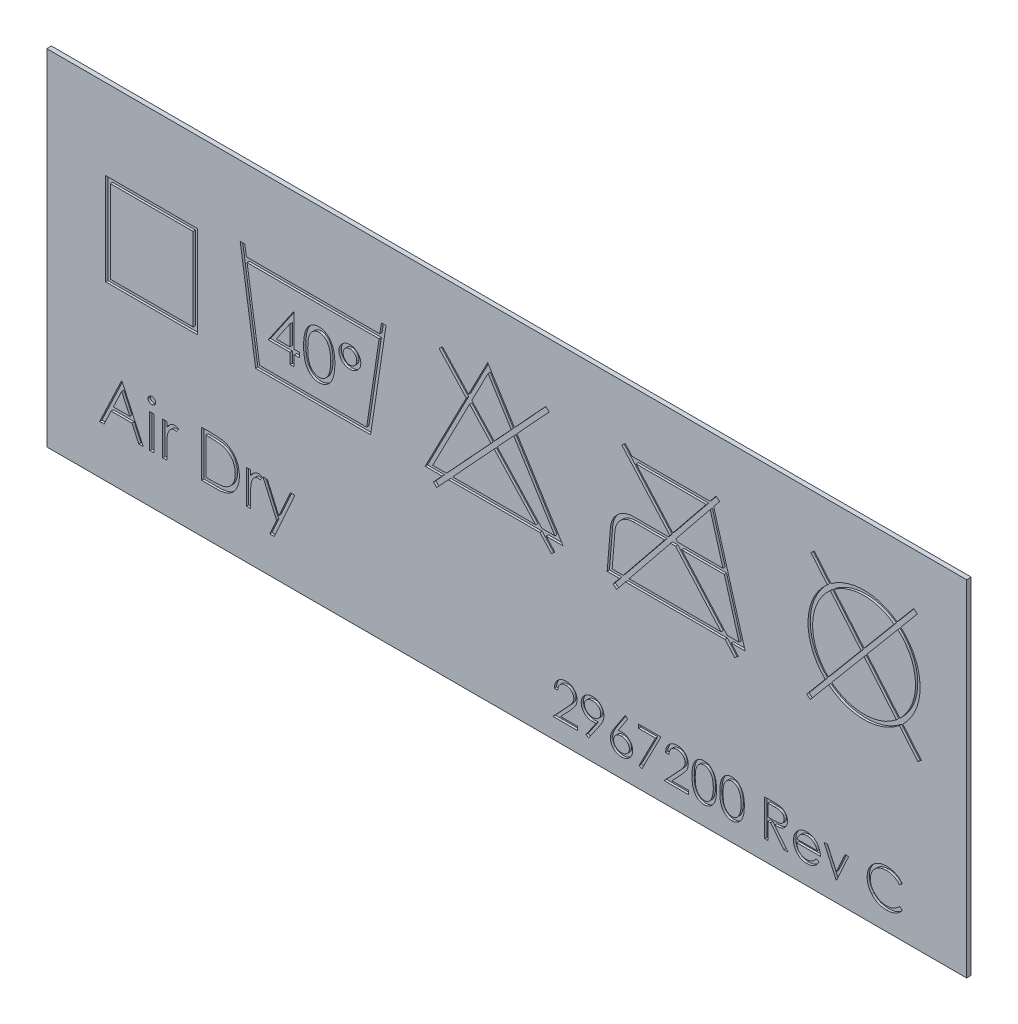
from build123d import *

# Parameters (mm, degrees)
ESQUISSE1_W         = 40
ESQUISSE1_H         = 15
EXTRUSION1_DEPTH    = 0.2
ESQUISSE2_W         = 4
ESQUISSE2_H         = 4
ESQUISSE2_W_2       = 3.6
ESQUISSE2_H_2       = 3.6
EXTRUSION2_DEPTH    = 0.1
EXTRUSION3_DEPTH    = 0.1
EXTRUSION4_DEPTH    = 0.1
EXTRUSION5_DEPTH    = 0.1
EXTRUSION6_DEPTH    = 0.1
ESQUISSE9_W         = 0.17948718
ESQUISSE9_H         = 1.461538462
EXTRUSION7_DEPTH    = 0.1
EXTRUSION8_DEPTH    = 0.1
F_2967200_P_N_DEPTH = 0.1


with BuildPart() as part:
    # Esquisse1 → Extrusion1 (new body)
    with BuildSketch(Plane.XY):
        with Locations((20, 7.5)):
            Rectangle(ESQUISSE1_W, ESQUISSE1_H)
    extrude(amount=EXTRUSION1_DEPTH)

    # Esquisse2 → Extrusion2 (cut)
    with BuildSketch(Plane.XY.offset(0.2)):
        with Locations((4.561634432, 9.5)):
            Rectangle(ESQUISSE2_W, ESQUISSE2_H)
        with Locations((4.561634432, 9.5)):
            Rectangle(ESQUISSE2_W_2, ESQUISSE2_H_2, mode=Mode.SUBTRACT)
    extrude(amount=-EXTRUSION2_DEPTH, mode=Mode.SUBTRACT)

    # Esquisse4 → Extrusion3 (cut)
    with BuildSketch(Plane.XY.offset(0.2)):
        Polygon((9.081285303, 7.5), (14.081285303, 7.5), (14.752835518, 11.949609006), (14.550570556, 11.949609006), (14.482714026, 11.5), (8.679856579, 11.5), (8.61200005, 11.949609006), (8.409735087, 11.949609006), align=None)
        Polygon((13.909205024, 7.7), (14.452529342, 11.3), (8.710041263, 11.3), (9.253365581, 7.7), align=None, mode=Mode.SUBTRACT)
    extrude(amount=-EXTRUSION3_DEPTH, mode=Mode.SUBTRACT)

    # Esquisse5 → Extrusion4 (cut)
    with BuildSketch(Plane.XY.offset(0.2)):
        Polygon((16.45419031, 7.5), (17.194115603, 7.5), (16.812102449, 7.086664072), (16.958979464, 6.950917461), (17.466452293, 7.5), (21.441928327, 7.5), (21.949401156, 6.950917461), (22.09627817, 7.086664072), (21.714265017, 7.5), (22.45419031, 7.5), (20.446062867, 10.723920665), (21.846580934, 12.239272765), (21.699703919, 12.375019376), (20.336416614, 10.899950737), (19.173967043, 12.76618946), (18.339841064, 11.151106359), (17.2086767, 12.375019376), (17.061799685, 12.239272765), (18.242212814, 10.96207288), align=None)
        Polygon((20.305303241, 10.571619599), (22.093988113, 7.7), (21.529421102, 7.7), (19.590358655, 9.79805387), align=None, mode=Mode.SUBTRACT)
        Polygon((19.190221042, 12.361813025), (20.195656989, 10.747649671), (19.45419031, 9.945387198), (18.4842453, 10.994861847), align=None, mode=Mode.SUBTRACT)
        Polygon((16.782580622, 7.7), (17.378959517, 7.7), (19.318021965, 9.79805387), (18.386617051, 10.805828368), align=None, mode=Mode.SUBTRACT)
        Polygon((19.45419031, 9.650720542), (17.651296207, 7.7), (21.257084413, 7.7), align=None, mode=Mode.SUBTRACT)
    extrude(amount=-EXTRUSION4_DEPTH, mode=Mode.SUBTRACT)

    # Esquisse6 → Extrusion5 (cut)
    with BuildSketch(Plane.XY.offset(0.2)):
        with BuildLine():
            Line((24.368953546, 7.5), (24.907458807, 7.5))
            Line((24.907458807, 7.5), (24.624718722, 7.149443823))
            Line((24.624718722, 7.149443823), (24.780394062, 7.023884321))
            Line((24.780394062, 7.023884321), (25.164403806, 7.5))
            Line((25.164403806, 7.5), (29.497063145, 7.5))
            Line((29.497063145, 7.5), (29.921729169, 7.020373335))
            Line((29.921729169, 7.020373335), (30.071469452, 7.15295481))
            Line((30.071469452, 7.15295481), (29.764192331, 7.5))
            Line((29.764192331, 7.5), (30.368953546, 7.5))
            Line((30.368953546, 7.5), (29.001249415, 12.257124998))
            Line((29.001249415, 12.257124998), (29.258437884, 12.576000923))
            Line((29.258437884, 12.576000923), (29.102762544, 12.701560425))
            Line((29.102762544, 12.701560425), (28.839391791, 12.375019376))
            Line((28.839391791, 12.375019376), (25.447803677, 12.375019376))
            Line((25.447803677, 12.375019376), (25.155572457, 12.705071412))
            Line((25.155572457, 12.705071412), (25.005832173, 12.572489937))
            Line((25.005832173, 12.572489937), (27.095299858, 10.212601552))
            Line((27.095299858, 10.212601552), (27.031173858, 10.13309473))
            Line((27.031173858, 10.13309473), (25.505714573, 10.13309473))
            ThreePointArc((25.505714573, 10.13309473), (24.828009529, 9.868428581), (24.509035653, 9.214526476))
            Line((24.509035653, 9.214526476), (24.368953546, 7.5))
        make_face()
        Polygon((29.403819928, 10.13309473), (27.432825142, 10.13309473), (27.357099607, 10.218620729), (28.847834638, 12.066913208), align=None, mode=Mode.SUBTRACT)
        Polygon((27.222638983, 10.370483363), (25.624885585, 12.175019376), (28.678082361, 12.175019376), align=None, mode=Mode.SUBTRACT)
        Polygon((30.103350361, 7.7), (29.461321218, 9.93309473), (27.60990705, 9.93309473), (29.587110423, 7.7), align=None, mode=Mode.SUBTRACT)
        with BuildLine():
            Line((24.585960592, 7.7), (25.068768237, 7.7))
            Line((25.068768237, 7.7), (26.869864428, 9.93309473))
            Line((26.869864428, 9.93309473), (25.505714573, 9.93309473))
            ThreePointArc((25.505714573, 9.93309473), (24.963550538, 9.721361811), (24.708371437, 9.198240126))
            Line((24.708371437, 9.198240126), (24.585960592, 7.7))
        make_face(mode=Mode.SUBTRACT)
        Polygon((27.342777864, 9.93309473), (27.126809426, 9.93309473), (25.325713236, 7.7), (29.319981237, 7.7), align=None, mode=Mode.SUBTRACT)
    extrude(amount=-EXTRUSION5_DEPTH, mode=Mode.SUBTRACT)

    # Esquisse8 → Extrusion6 (cut)
    with BuildSketch(Plane.XY.offset(0.2)):
        with BuildLine():
            Line((33.22626337, 12.637305792), (33.944914447, 11.780302823))
            ThreePointArc((33.944914447, 11.780302823), (33.103666491, 9.999107525), (33.853844248, 8.177682767))
            Line((33.853844248, 8.177682767), (33.048426747, 7.217209443))
            Line((33.048426747, 7.217209443), (33.201676114, 7.088700177))
            Line((33.201676114, 7.088700177), (34.003845044, 8.045299528))
            ThreePointArc((34.003845044, 8.045299528), (35.540397741, 7.5), (37.076950438, 8.045299528))
            Line((37.076950438, 8.045299528), (37.879119369, 7.088700177))
            Line((37.879119369, 7.088700177), (38.032368736, 7.217209443))
            Line((38.032368736, 7.217209443), (37.226951235, 8.177682767))
            ThreePointArc((37.226951235, 8.177682767), (37.977128991, 9.999107525), (37.135881035, 11.780302823))
            Line((37.135881035, 11.780302823), (37.854532113, 12.637305792))
            Line((37.854532113, 12.637305792), (37.701282746, 12.765815058))
            Line((37.701282746, 12.765815058), (36.979383098, 11.904938117))
            ThreePointArc((36.979383098, 11.904938117), (35.540397741, 12.375019376), (34.101412385, 11.904938117))
            Line((34.101412385, 11.904938117), (33.379512737, 12.765815058))
            Line((33.379512737, 12.765815058), (33.22626337, 12.637305792))
        make_face()
        with BuildLine():
            Line((35.409891492, 10.033294134), (33.982662082, 8.331300106))
            ThreePointArc((33.982662082, 8.331300106), (33.303736365, 9.999117238), (34.073441138, 11.627032677))
            Line((34.073441138, 11.627032677), (35.409891492, 10.033294134))
        make_face(mode=Mode.SUBTRACT)
        with BuildLine():
            Line((35.67090399, 10.033294134), (37.0981334, 8.331300106))
            ThreePointArc((37.0981334, 8.331300106), (37.777059118, 9.999117238), (37.007354344, 11.627032677))
            Line((37.007354344, 11.627032677), (35.67090399, 10.033294134))
        make_face(mode=Mode.SUBTRACT)
        with BuildLine():
            Line((35.540397741, 9.877663333), (34.132371735, 8.198569675))
            ThreePointArc((34.132371735, 8.198569675), (35.540397741, 7.7), (36.948423747, 8.198569675))
            Line((36.948423747, 8.198569675), (35.540397741, 9.877663333))
        make_face(mode=Mode.SUBTRACT)
        with BuildLine():
            Line((36.850565263, 11.751320778), (35.540397741, 10.188924935))
            Line((35.540397741, 10.188924935), (34.230230219, 11.751320778))
            ThreePointArc((34.230230219, 11.751320778), (35.540397741, 12.175019376), (36.850565263, 11.751320778))
        make_face(mode=Mode.SUBTRACT)
    extrude(amount=-EXTRUSION6_DEPTH, mode=Mode.SUBTRACT)

    # Esquisse9 → Extrusion7 (cut)
    # profile 1 of 7: a face of its own
    with BuildSketch(Plane.XY.offset(0.2)):
        Polygon((3.271734861, 4.110208043), (4.194811784, 2.110208043), (3.999699604, 2.110208043), (3.704026528, 2.751233684), (2.797375887, 2.751233684), (2.493289348, 2.110208043), (2.297375887, 2.110208043), (3.246093835, 4.110208043), align=None)
        Polygon((3.256911143, 3.720384325), (2.894731656, 2.956361889), (3.609475246, 2.956361889), align=None, mode=Mode.SUBTRACT)
    # profile 2 of 7: a face of its own
    with BuildSketch(Plane.XY.offset(0.2)):
        with BuildLine():
            add(Edge.make_bspline(
                [(4.565805374, 4.18713112), (4.576943268, 4.186614461), (4.598753406, 4.185602745), (4.630292416, 4.176939044), (4.659010708, 4.162253509), (4.684483698, 4.142550834), (4.706341919, 4.119379724), (4.721645182, 4.092373456), (4.731480837, 4.063197091), (4.732668583, 4.042845612), (4.733273322, 4.032483684)],
                knots=[0, 0, 0, 0, 1.055194115, 2.066272739, 3.074728998, 4.095836921, 5.109056067, 6.073838105, 7.019297344, 8, 8, 8, 8], degree=3))
            add(Edge.make_bspline(
                [(4.733273322, 4.032483684), (4.732654945, 4.022390739), (4.731432487, 4.002438182), (4.72165278, 3.973767627), (4.706211501, 3.947136608), (4.684497715, 3.924010487), (4.659006994, 3.904318705), (4.630293402, 3.889630282), (4.598753146, 3.880967347), (4.576943181, 3.879955525), (4.565805374, 3.879438812)],
                knots=[0, 0, 0, 0, 0.96129708, 1.900370562, 2.859976407, 3.87933698, 4.906634145, 5.921202961, 6.938410037, 8, 8, 8, 8], degree=3))
            add(Edge.make_bspline(
                [(4.565805374, 3.879438812), (4.554794931, 3.879935795), (4.533364542, 3.880903108), (4.502297775, 3.889800261), (4.473824353, 3.904323731), (4.448301682, 3.923881551), (4.427027286, 3.947278635), (4.411542529, 3.973751374), (4.401785408, 4.00244232), (4.400559906, 4.022392129), (4.399939989, 4.032483684)],
                knots=[0, 0, 0, 0, 1.054934014, 2.053291228, 3.073705704, 4.106921865, 5.123545215, 6.088680038, 7.033164197, 8, 8, 8, 8], degree=3))
            add(Edge.make_bspline(
                [(4.399939989, 4.032483684), (4.400546324, 4.042844169), (4.401737205, 4.063192817), (4.411549843, 4.092389978), (4.426898304, 4.119236551), (4.448315769, 4.142679693), (4.473820604, 4.162248513), (4.502298744, 4.176769074), (4.533364286, 4.185666982), (4.554794844, 4.18663419), (4.565805374, 4.18713112)],
                knots=[0, 0, 0, 0, 0.98631895, 1.937192651, 2.907499808, 3.917963147, 4.944918757, 5.95915025, 6.951458133, 8, 8, 8, 8], degree=3))
        make_face()
    # profile 3 of 7: a face of its own
    with BuildSketch(Plane.XY.offset(0.2)):
        with Locations((4.566606656, 2.840977274)):
            Rectangle(ESQUISSE9_W, ESQUISSE9_H)
    # profile 4 of 7: a face of its own
    with BuildSketch(Plane.XY.offset(0.2)):
        with BuildLine():
            Line((5.04096563, 3.571746505), (5.22045281, 3.571746505))
            Line((5.22045281, 3.571746505), (5.22045281, 3.356602274))
            add(Edge.make_bspline(
                [(5.22045281, 3.356602274), (5.233703529, 3.376634176), (5.259045427, 3.414945032), (5.301167101, 3.465613204), (5.344311861, 3.50756466), (5.388686254, 3.540995242), (5.434616597, 3.56603131), (5.481094855, 3.584370187), (5.528852266, 3.595214367), (5.560944794, 3.596662172), (5.577023322, 3.59738753)],
                knots=[0, 0, 0, 0, 1.2804753, 2.448899062, 3.506932113, 4.484331642, 5.4025378, 6.288909075, 7.142734305, 8, 8, 8, 8], degree=3))
            add(Edge.make_bspline(
                [(5.577023322, 3.59738753), (5.589495509, 3.596707229), (5.615157843, 3.595307466), (5.654005038, 3.585472709), (5.694029867, 3.569770982), (5.719825517, 3.55500514), (5.733273322, 3.547307402)],
                knots=[0, 0, 0, 0, 0.901110191, 1.854092781, 2.881294221, 4, 4, 4, 4], degree=3))
            Line((5.733273322, 3.547307402), (5.63471563, 3.391858684))
            add(Edge.make_bspline(
                [(5.63471563, 3.391858684), (5.626081904, 3.395710265), (5.609693438, 3.403021302), (5.5857194, 3.411673879), (5.563615779, 3.416768688), (5.549533746, 3.417540527), (5.542968835, 3.417900351)],
                knots=[0, 0, 0, 0, 1.180555205, 2.24091978, 3.179933427, 4, 4, 4, 4], degree=3))
            add(Edge.make_bspline(
                [(5.542968835, 3.417900351), (5.528565559, 3.416940329), (5.49918705, 3.414982164), (5.456053051, 3.39958856), (5.414197505, 3.374716994), (5.380956555, 3.347133501), (5.355218125, 3.32053476), (5.336852281, 3.297307101), (5.320004997, 3.271262169), (5.303907729, 3.242845207), (5.289241275, 3.211571009), (5.275552892, 3.17775203), (5.263176399, 3.141349099), (5.256119117, 3.115987659), (5.252504092, 3.102996505)],
                knots=[0, 0, 0, 0, 1.125678352, 2.296057538, 3.5422874, 4.923748041, 5.663163013, 6.437101912, 7.23742474, 8.08941207, 8.991984279, 9.93940061, 10.944477711, 12, 12, 12, 12], degree=3))
            add(Edge.make_bspline(
                [(5.252504092, 3.102996505), (5.249799867, 3.091409548), (5.243810214, 3.06574532), (5.237986479, 3.022689021), (5.232232468, 2.971818358), (5.228177258, 2.912991734), (5.224418377, 2.846356052), (5.22229833, 2.771809797), (5.220525106, 2.689276453), (5.22047764, 2.631576823), (5.22045281, 2.60139394)],
                knots=[0, 0, 0, 0, 0.566838948, 1.255505196, 2.06880316, 3.007127437, 4.065329342, 5.249902469, 6.561414163, 8, 8, 8, 8], degree=3))
            Line((5.22045281, 2.60139394), (5.22045281, 2.110208043))
            Line((5.22045281, 2.110208043), (5.04096563, 2.110208043))
            Line((5.04096563, 2.110208043), (5.04096563, 3.571746505))
        make_face()
    # profile 5 of 7: a face of its own
    with BuildSketch(Plane.XY.offset(0.2)):
        with BuildLine():
            Line((6.733273322, 2.110208043), (6.733273322, 4.110208043))
            Line((6.733273322, 4.110208043), (7.137119476, 4.110208043))
            add(Edge.make_bspline(
                [(7.137119476, 4.110208043), (7.172244612, 4.109955146), (7.240106193, 4.10946655), (7.338170448, 4.106368612), (7.428904027, 4.100888346), (7.512008518, 4.09290576), (7.587712067, 4.083104026), (7.655802701, 4.070818081), (7.716632497, 4.056310555), (7.754043605, 4.043941726), (7.771734861, 4.038092658)],
                knots=[0, 0, 0, 0, 1.314313732, 2.53924729, 3.670748893, 4.714932338, 5.66265055, 6.526160246, 7.303039223, 8, 8, 8, 8], degree=3))
            add(Edge.make_bspline(
                [(7.771734861, 4.038092658), (7.794874712, 4.029275112), (7.840629679, 4.011839973), (7.905776606, 3.978950658), (7.967105385, 3.941686028), (8.024944896, 3.899996964), (8.07797394, 3.85270305), (8.128264167, 3.801813287), (8.173758295, 3.745477093), (8.215420178, 3.684862814), (8.252983412, 3.620684498), (8.285634359, 3.553064436), (8.312750927, 3.482346032), (8.335261342, 3.408725947), (8.353002175, 3.332042303), (8.365106136, 3.252205808), (8.373089559, 3.169531985), (8.373891874, 3.113432292), (8.374298963, 3.084967658)],
                knots=[0, 0, 0, 0, 0.984719456, 1.947108742, 2.898477687, 3.838006223, 4.779231079, 5.722358779, 6.681677486, 7.655904652, 8.64651281, 9.637519902, 10.640069247, 11.656948941, 12.698408672, 13.768548281, 14.867775369, 16, 16, 16, 16], degree=3))
            add(Edge.make_bspline(
                [(8.374298963, 3.084967658), (8.373939553, 3.060246951), (8.373231299, 3.011532214), (8.366871689, 2.939737417), (8.357628078, 2.870072519), (8.343317108, 2.802869262), (8.325944243, 2.737538851), (8.303679014, 2.674777569), (8.278173016, 2.614009678), (8.248430228, 2.556056834), (8.215778008, 2.50115205), (8.180737012, 2.449394606), (8.143344615, 2.40152305), (8.103244253, 2.357392415), (8.060954129, 2.317069227), (8.016197369, 2.280216647), (7.968858483, 2.247555758), (7.919149498, 2.217803125), (7.865620282, 2.191848636), (7.80725693, 2.169888631), (7.743810542, 2.151690565), (7.675436853, 2.136507196), (7.602017722, 2.124463023), (7.52348117, 2.116390799), (7.439947862, 2.11093198), (7.382588282, 2.110454041), (7.353064989, 2.110208043)],
                knots=[0, 0, 0, 0, 1.105936401, 2.179363191, 3.223086493, 4.248585256, 5.251745608, 6.245858792, 7.225916811, 8.198733463, 9.158002045, 10.082870192, 10.993790845, 11.873723703, 12.748670949, 13.606408763, 14.465103618, 15.319838547, 16.196477973, 17.123216899, 18.106603292, 19.147568657, 20.255746949, 21.433717677, 22.679120308, 24, 24, 24, 24], degree=3))
            Line((7.353064989, 2.110208043), (6.733273322, 2.110208043))
        make_face()
        with BuildLine():
            Line((6.912760502, 2.315336248), (7.14232781, 2.315336248))
            add(Edge.make_bspline(
                [(7.14232781, 2.315336248), (7.17531545, 2.315478017), (7.238762763, 2.315750692), (7.329995905, 2.318143379), (7.41335556, 2.322053058), (7.488853565, 2.327524531), (7.556447293, 2.33476374), (7.616278008, 2.342835113), (7.668149584, 2.352890799), (7.699537833, 2.362005633), (7.714042553, 2.366217658)],
                knots=[0, 0, 0, 0, 1.375205317, 2.645023457, 3.804390687, 4.853969522, 5.800190428, 6.637939096, 7.370582563, 8, 8, 8, 8], degree=3))
            add(Edge.make_bspline(
                [(7.714042553, 2.366217658), (7.73229876, 2.37264712), (7.768375125, 2.385352476), (7.820307173, 2.408528283), (7.868739748, 2.435980894), (7.914516905, 2.466496479), (7.956989279, 2.501151337), (7.996660203, 2.539191902), (8.033449804, 2.580811774), (8.06697798, 2.625959295), (8.096982725, 2.674353464), (8.122966285, 2.725518512), (8.145738588, 2.778893832), (8.16361207, 2.835299065), (8.177620975, 2.894229956), (8.187543654, 2.955690649), (8.193723496, 3.019669667), (8.194444324, 3.063185167), (8.194811784, 3.085368299)],
                knots=[0, 0, 0, 0, 0.998632004, 1.973411704, 2.929992603, 3.868527914, 4.809262121, 5.754881198, 6.702106254, 7.672490631, 8.653608572, 9.636854334, 10.631411391, 11.644891563, 12.686317036, 13.754757253, 14.855430412, 16, 16, 16, 16], degree=3))
            add(Edge.make_bspline(
                [(8.194811784, 3.085368299), (8.194518477, 3.10875886), (8.193942273, 3.154709822), (8.186699809, 3.222133076), (8.176116063, 3.286979163), (8.1608111, 3.349252417), (8.141307741, 3.409074333), (8.116967945, 3.466114053), (8.089158449, 3.520973978), (8.056070828, 3.572387901), (8.019833346, 3.621012535), (7.979617415, 3.665558201), (7.936061964, 3.706126372), (7.88964205, 3.743348837), (7.839049422, 3.77572808), (7.785475884, 3.804691898), (7.728135501, 3.829272407), (7.688242532, 3.842346043), (7.667968835, 3.848990094)],
                knots=[0, 0, 0, 0, 1.122418816, 2.205001699, 3.251619955, 4.274784885, 5.280384055, 6.268708349, 7.249350384, 8.229342522, 9.199999885, 10.157847722, 11.105861043, 12.055065948, 13.010012805, 13.98527497, 14.976112212, 16, 16, 16, 16], degree=3))
            add(Edge.make_bspline(
                [(7.667968835, 3.848990094), (7.651196752, 3.853628053), (7.6155347, 3.863489626), (7.557340721, 3.874246982), (7.491846349, 3.883735267), (7.418760806, 3.891768432), (7.338167401, 3.897532616), (7.250004151, 3.901859081), (7.154232948, 3.904777157), (7.087842929, 3.904976418), (7.053385502, 3.905079838)],
                knots=[0, 0, 0, 0, 0.674548936, 1.434276114, 2.292660221, 3.240891867, 4.284742987, 5.42552168, 6.663806718, 8, 8, 8, 8], degree=3))
            Line((7.053385502, 3.905079838), (6.912760502, 3.905079838))
            Line((6.912760502, 3.905079838), (6.912760502, 2.315336248))
        make_face(mode=Mode.SUBTRACT)
    # profile 6 of 7: a face of its own
    with BuildSketch(Plane.XY.offset(0.2)):
        with BuildLine():
            Line((8.681991271, 3.571746505), (8.861478451, 3.571746505))
            Line((8.861478451, 3.571746505), (8.861478451, 3.356602274))
            add(Edge.make_bspline(
                [(8.861478451, 3.356602274), (8.87472917, 3.376634176), (8.900071068, 3.414945032), (8.942192742, 3.465613204), (8.985337502, 3.50756466), (9.029711895, 3.540995242), (9.075642238, 3.56603131), (9.122120496, 3.584370187), (9.169877907, 3.595214367), (9.201970435, 3.596662172), (9.218048963, 3.59738753)],
                knots=[0, 0, 0, 0, 1.2804753, 2.448899062, 3.506932113, 4.484331642, 5.4025378, 6.288909075, 7.142734305, 8, 8, 8, 8], degree=3))
            add(Edge.make_bspline(
                [(9.218048963, 3.59738753), (9.23052115, 3.596707229), (9.256183484, 3.595307466), (9.295030679, 3.585472709), (9.335055508, 3.569770982), (9.360851158, 3.55500514), (9.374298963, 3.547307402)],
                knots=[0, 0, 0, 0, 0.901110191, 1.854092781, 2.881294221, 4, 4, 4, 4], degree=3))
            Line((9.374298963, 3.547307402), (9.275741271, 3.391858684))
            add(Edge.make_bspline(
                [(9.275741271, 3.391858684), (9.267107545, 3.395710265), (9.250719079, 3.403021302), (9.226745041, 3.411673879), (9.20464142, 3.416768688), (9.190559387, 3.417540527), (9.183994476, 3.417900351)],
                knots=[0, 0, 0, 0, 1.180555205, 2.24091978, 3.179933427, 4, 4, 4, 4], degree=3))
            add(Edge.make_bspline(
                [(9.183994476, 3.417900351), (9.1695912, 3.416940329), (9.140212691, 3.414982164), (9.097078692, 3.39958856), (9.055223146, 3.374716994), (9.021982196, 3.347133501), (8.996243766, 3.32053476), (8.977877922, 3.297307101), (8.961030639, 3.271262169), (8.94493337, 3.242845207), (8.930266916, 3.211571009), (8.916578533, 3.17775203), (8.90420204, 3.141349099), (8.897144758, 3.115987659), (8.893529733, 3.102996505)],
                knots=[0, 0, 0, 0, 1.125678352, 2.296057538, 3.5422874, 4.923748041, 5.663163013, 6.437101912, 7.23742474, 8.08941207, 8.991984279, 9.93940061, 10.944477711, 12, 12, 12, 12], degree=3))
            add(Edge.make_bspline(
                [(8.893529733, 3.102996505), (8.890825508, 3.091409548), (8.884835856, 3.06574532), (8.87901212, 3.022689021), (8.873258109, 2.971818358), (8.869202899, 2.912991734), (8.865444018, 2.846356052), (8.863323971, 2.771809797), (8.861550747, 2.689276453), (8.861503281, 2.631576823), (8.861478451, 2.60139394)],
                knots=[0, 0, 0, 0, 0.566838948, 1.255505196, 2.06880316, 3.007127437, 4.065329342, 5.249902469, 6.561414163, 8, 8, 8, 8], degree=3))
            Line((8.861478451, 2.60139394), (8.861478451, 2.110208043))
            Line((8.861478451, 2.110208043), (8.681991271, 2.110208043))
            Line((8.681991271, 2.110208043), (8.681991271, 3.571746505))
        make_face()
    # profile 7 of 7: a face of its own
    with BuildSketch(Plane.XY.offset(0.2)):
        Polygon((9.399939989, 3.571746505), (9.593449604, 3.571746505), (10.088241271, 2.452355479), (10.590645117, 3.571746505), (10.784555374, 3.571746505), (9.887119476, 1.571746505), (9.69320922, 1.571746505), (9.990885502, 2.234807402), align=None)
    extrude(amount=-EXTRUSION7_DEPTH, mode=Mode.SUBTRACT)

    # Esquisse10 → Extrusion8 (cut)
    # profile 1 of 3: a face of its own
    with BuildSketch(Plane.XY.offset(0.2)):
        Polygon((10.720935601, 10.442902149), (10.757393934, 10.442902149), (10.757393934, 9.058286764), (10.988163165, 9.058286764), (10.988163165, 8.853158559), (10.757393934, 8.853158559), (10.757393934, 8.391620097), (10.577906754, 8.391620097), (10.577906754, 8.853158559), (9.629188806, 8.853158559), align=None)
        Polygon((10.577906754, 9.058286764), (10.577906754, 9.926876508), (9.981752908, 9.058286764), align=None, mode=Mode.SUBTRACT)
    # profile 2 of 3: a face of its own
    with BuildSketch(Plane.XY.offset(0.2)):
        with BuildLine():
            add(Edge.make_bspline(
                [(11.167650344, 9.390818815), (11.167837783, 9.422874465), (11.168201886, 9.485143028), (11.172252412, 9.575877109), (11.178981179, 9.660997274), (11.188202535, 9.740507598), (11.199424238, 9.814428606), (11.214404516, 9.882562753), (11.231440403, 9.945225385), (11.251184658, 10.002620842), (11.273463395, 10.055522386), (11.297711544, 10.104908215), (11.324891426, 10.150703605), (11.353449662, 10.193639486), (11.384542275, 10.233013025), (11.417284441, 10.269380261), (11.452954084, 10.30190069), (11.49033866, 10.331527149), (11.52977664, 10.357498275), (11.570143878, 10.380374126), (11.611718224, 10.399916907), (11.654613186, 10.41528287), (11.698443219, 10.427974783), (11.743361543, 10.436654182), (11.789442322, 10.442115272), (11.820545999, 10.442637368), (11.836320216, 10.442902149)],
                knots=[0, 0, 0, 0, 1.646270934, 3.197905019, 4.663502075, 6.030701355, 7.308322542, 8.50163776, 9.611534131, 10.641858119, 11.616356847, 12.558055219, 13.465016945, 14.349605745, 15.204443733, 16.039544428, 16.859896111, 17.680448484, 18.487036065, 19.28249412, 20.06191084, 20.843045899, 21.620316918, 22.403196591, 23.190181807, 24, 24, 24, 24], degree=3))
            add(Edge.make_bspline(
                [(11.836320216, 10.442902149), (11.852226204, 10.442623397), (11.883858209, 10.442069048), (11.930624137, 10.436741081), (11.97630967, 10.427900439), (12.020720035, 10.415374168), (12.064220027, 10.399833781), (12.106469403, 10.380355429), (12.147730592, 10.35768179), (12.1873479, 10.331039575), (12.225756251, 10.301335417), (12.26201223, 10.267756749), (12.296119136, 10.230642624), (12.328505025, 10.19039013), (12.358251081, 10.146227224), (12.386578756, 10.098922019), (12.411934205, 10.047647239), (12.43635402, 9.9932584), (12.457432298, 9.934250595), (12.476441581, 9.870956446), (12.491800991, 9.802628339), (12.504594861, 9.729624771), (12.51450623, 9.651677637), (12.521724883, 9.568954028), (12.525538074, 9.48139952), (12.526256189, 9.421537891), (12.526624703, 9.390818815)],
                knots=[0, 0, 0, 0, 0.810914788, 1.612654377, 2.396697861, 3.181598691, 3.963628158, 4.749916497, 5.551656086, 6.361998678, 7.18212741, 8.025565596, 8.878627764, 9.750805457, 10.657531673, 11.591944965, 12.560506719, 13.57287815, 14.630710178, 15.753379473, 16.941251878, 18.199788006, 19.531962791, 20.947069417, 22.433333509, 24, 24, 24, 24], degree=3))
            add(Edge.make_bspline(
                [(12.526624703, 9.390818815), (12.526252369, 9.360233725), (12.525526891, 9.300639924), (12.52176763, 9.213479367), (12.514362698, 9.131194771), (12.505099848, 9.053588792), (12.492270726, 8.980984438), (12.476496345, 8.913130468), (12.458981875, 8.849733855), (12.437361993, 8.791313963), (12.41369873, 8.737055836), (12.387952903, 8.686388894), (12.360370146, 8.638865298), (12.330319434, 8.594865443), (12.298288912, 8.554077639), (12.263593033, 8.517221854), (12.227209842, 8.483410042), (12.188688461, 8.453323397), (12.148453289, 8.426989223), (12.107333817, 8.403438452), (12.064600455, 8.38444834), (12.021221624, 8.368142603), (11.976576844, 8.355685201), (11.930721763, 8.34707157), (11.883889629, 8.341030513), (11.852231591, 8.340569668), (11.836320216, 8.340338046)],
                knots=[0, 0, 0, 0, 1.561518951, 3.042555995, 4.452378317, 5.7783523, 7.031515105, 8.214008947, 9.334062868, 10.386615937, 11.391082383, 12.354592575, 13.286541444, 14.194233754, 15.072674879, 15.931287219, 16.775624067, 17.606195743, 18.42308326, 19.229000347, 20.022332153, 20.807536673, 21.593273796, 22.3848459, 23.188221202, 24, 24, 24, 24], degree=3))
            add(Edge.make_bspline(
                [(11.836320216, 8.340338046), (11.820546437, 8.340604535), (11.789443622, 8.341129999), (11.743356522, 8.346566417), (11.698623697, 8.355306704), (11.655024409, 8.367544764), (11.612334972, 8.38252467), (11.571137094, 8.402041061), (11.530972703, 8.424517672), (11.491948957, 8.450115056), (11.454799151, 8.479441732), (11.419314233, 8.511878468), (11.386385651, 8.548234703), (11.355737596, 8.587936373), (11.326609546, 8.630618226), (11.299815618, 8.676863011), (11.275032273, 8.72648736), (11.25237885, 8.77981188), (11.232293899, 8.837614696), (11.214552352, 8.900557084), (11.200544262, 8.96919459), (11.188554002, 9.042975943), (11.178882926, 9.122218189), (11.172280454, 9.206964348), (11.168199703, 9.29716161), (11.167836805, 9.359030052), (11.167650344, 9.390818815)],
                knots=[0, 0, 0, 0, 0.810891512, 1.598919785, 2.382837074, 3.152667961, 3.926044502, 4.706494248, 5.493654104, 6.291793342, 7.103789334, 7.925228297, 8.761435821, 9.622817696, 10.50288917, 11.416980706, 12.369136599, 13.353924996, 14.394355917, 15.514179734, 16.714354668, 17.994756427, 19.357759367, 20.818452758, 22.365282078, 24, 24, 24, 24], degree=3))
        make_face()
        with BuildLine():
            add(Edge.make_bspline(
                [(11.347137524, 9.391620097), (11.347205779, 9.364906555), (11.34733825, 9.313060815), (11.350798936, 9.237721809), (11.355513354, 9.16745305), (11.361594095, 9.102165315), (11.370624351, 9.042079593), (11.380742516, 8.986782631), (11.39305571, 8.936567067), (11.407624292, 8.891088318), (11.424218061, 8.849574565), (11.442335698, 8.810945299), (11.461798968, 8.774744193), (11.48358134, 8.741296416), (11.507304233, 8.710492894), (11.53243181, 8.681788418), (11.559901858, 8.656190143), (11.597903996, 8.625489083), (11.64807341, 8.593763864), (11.711285099, 8.566137527), (11.7762385, 8.548776123), (11.820324928, 8.546568263), (11.842329831, 8.545466251)],
                knots=[0, 0, 0, 0, 1.459021318, 2.831673884, 4.118529203, 5.306027144, 6.411944654, 7.436330062, 8.375795394, 9.233974572, 10.042671642, 10.816086306, 11.563610507, 12.285937304, 12.993564865, 13.685989202, 14.367179055, 15.041617293, 16.353048772, 17.594441528, 18.799311195, 20, 20, 20, 20], degree=3))
            add(Edge.make_bspline(
                [(11.842329831, 8.545466251), (11.864477072, 8.546379269), (11.908725828, 8.548203419), (11.973373711, 8.565802698), (12.036133866, 8.59235672), (12.085317832, 8.623755295), (12.122736428, 8.653657197), (12.149546136, 8.679151282), (12.174153021, 8.707697492), (12.19749135, 8.738497089), (12.218896536, 8.772138509), (12.238361186, 8.808459981), (12.256123099, 8.847562368), (12.266242554, 8.874859362), (12.27141637, 8.88881561)],
                knots=[0, 0, 0, 0, 1.353760809, 2.704726607, 4.075137775, 5.516104923, 6.260822281, 7.007110065, 7.778089737, 8.566572457, 9.372053459, 10.217411131, 11.088608312, 12, 12, 12, 12], degree=3))
            add(Edge.make_bspline(
                [(12.27141637, 8.88881561), (12.277445951, 8.906661176), (12.289688588, 8.942895327), (12.305466745, 8.999103128), (12.317892687, 9.058076136), (12.329071753, 9.119461917), (12.336702071, 9.183713174), (12.342843678, 9.250631108), (12.346461214, 9.320266172), (12.346909643, 9.367577596), (12.347137524, 9.391620097)],
                knots=[0, 0, 0, 0, 0.884706709, 1.796334032, 2.740027952, 3.714592787, 4.726048262, 5.777819803, 6.87074269, 8, 8, 8, 8], degree=3))
            add(Edge.make_bspline(
                [(12.347137524, 9.391620097), (12.34682313, 9.41565871), (12.346208108, 9.462683376), (12.343857258, 9.531550908), (12.337786644, 9.596961057), (12.33104429, 9.659195613), (12.321103021, 9.717910071), (12.310384275, 9.77359596), (12.295983582, 9.825563403), (12.280600853, 9.874626021), (12.262994913, 9.920226395), (12.243614493, 9.96257713), (12.222916345, 10.001882687), (12.200435065, 10.038035225), (12.176437532, 10.071196678), (12.150290361, 10.100702161), (12.123030719, 10.127466142), (12.08484947, 10.158016182), (12.034864162, 10.189165722), (11.972666649, 10.217831871), (11.907940567, 10.234293752), (11.864184307, 10.236614716), (11.842329831, 10.237773944)],
                knots=[0, 0, 0, 0, 1.31362396, 2.569729283, 3.763502607, 4.902122613, 5.988968491, 7.01645872, 7.998833611, 8.933434873, 9.825090667, 10.667526885, 11.477055099, 12.250526234, 12.991942729, 13.710640831, 14.402115721, 15.076753259, 16.378508321, 17.609869233, 18.806226677, 20, 20, 20, 20], degree=3))
            add(Edge.make_bspline(
                [(11.842329831, 10.237773944), (11.820209493, 10.236613117), (11.775928518, 10.234289349), (11.710529687, 10.217893204), (11.647841486, 10.189314366), (11.597988358, 10.157913011), (11.55978048, 10.128005404), (11.532876084, 10.102070287), (11.507649699, 10.073700999), (11.484411014, 10.042614191), (11.462645709, 10.009205409), (11.442656559, 9.97321183), (11.424646656, 9.93445105), (11.408026921, 9.892955944), (11.3934139, 9.847481119), (11.381360206, 9.797327408), (11.370224747, 9.742206327), (11.362341737, 9.68179518), (11.355333876, 9.616491092), (11.350830249, 9.54604691), (11.347326673, 9.47058155), (11.347201836, 9.418467745), (11.347137524, 9.391620097)],
                knots=[0, 0, 0, 0, 1.207732386, 2.417664972, 3.655092373, 4.956220595, 5.625982001, 6.301752483, 6.994047911, 7.697131622, 8.419323945, 9.170223765, 9.943494443, 10.752040957, 11.610060368, 12.549350801, 13.567764191, 14.679664412, 15.874934091, 17.154273443, 18.533957287, 20, 20, 20, 20], degree=3))
        make_face(mode=Mode.SUBTRACT)
    # profile 3 of 3: a face of its own
    with BuildSketch(Plane.XY.offset(0.2)):
        with BuildLine():
            add(Edge.make_bspline(
                [(13.654829831, 9.981363687), (13.654537807, 9.965442059), (13.653963185, 9.934112713), (13.646637534, 9.888151256), (13.636076007, 9.84391606), (13.620754189, 9.801578808), (13.600908526, 9.76143513), (13.577276789, 9.722886403), (13.548377617, 9.686965876), (13.516368106, 9.652621282), (13.480854741, 9.621781277), (13.443578724, 9.594149443), (13.403965919, 9.571293481), (13.362705606, 9.552335229), (13.319417929, 9.537867422), (13.274341713, 9.527519828), (13.227412139, 9.5208343), (13.195450928, 9.520164398), (13.179268934, 9.519825226)],
                knots=[0, 0, 0, 0, 1.034311374, 2.035237678, 3.018835879, 3.988535298, 4.955586962, 5.926724039, 6.922210896, 7.948140028, 8.9758318, 9.976305946, 10.960823755, 11.944000181, 12.924372957, 13.922847624, 14.948335623, 16, 16, 16, 16], degree=3))
            add(Edge.make_bspline(
                [(13.179268934, 9.519825226), (13.163086011, 9.520161573), (13.131122965, 9.520825895), (13.084206774, 9.527552114), (13.03903944, 9.537760221), (12.996006913, 9.552753837), (12.954870593, 9.571762333), (12.915388901, 9.594581902), (12.877969443, 9.622036373), (12.843131944, 9.653482953), (12.811166508, 9.687760045), (12.782935282, 9.724256794), (12.759114563, 9.762919183), (12.739878874, 9.803704981), (12.724466605, 9.846314447), (12.713778858, 9.890925484), (12.707095285, 9.937490075), (12.706444254, 9.969187578), (12.706111883, 9.985370097)],
                knots=[0, 0, 0, 0, 1.048877944, 2.071648865, 3.067478027, 4.048049482, 5.020748126, 6.00265741, 7.000480754, 8.024717489, 9.042009667, 10.036368859, 11.012301115, 11.980826395, 12.956105095, 13.945510705, 14.951122056, 16, 16, 16, 16], degree=3))
            add(Edge.make_bspline(
                [(12.706111883, 9.985370097), (12.706630014, 10.000880336), (12.7076484, 10.031365643), (12.714049741, 10.076424915), (12.725464861, 10.11953788), (12.740448755, 10.161293016), (12.76110207, 10.200646516), (12.784849382, 10.239064673), (12.814169795, 10.274983322), (12.846718546, 10.309294271), (12.882358161, 10.340581121), (12.920191899, 10.368167047), (12.96008696, 10.390973508), (13.001518171, 10.409894481), (13.044525584, 10.424916495), (13.089282724, 10.435138095), (13.135658078, 10.441926325), (13.167224898, 10.442573226), (13.183275344, 10.442902149)],
                knots=[0, 0, 0, 0, 1.014023411, 1.9930587, 2.967060154, 3.925483522, 4.885932443, 5.866834192, 6.873010876, 7.910365301, 8.955806314, 9.968626493, 10.965901813, 11.95427271, 12.942643608, 13.937891749, 14.95150171, 16, 16, 16, 16], degree=3))
            add(Edge.make_bspline(
                [(13.183275344, 10.442902149), (13.199324728, 10.442569287), (13.23088946, 10.44191464), (13.277151044, 10.435201399), (13.321728616, 10.424817385), (13.364449845, 10.410085703), (13.405350913, 10.390848856), (13.444752988, 10.368155863), (13.482190303, 10.340706656), (13.516995267, 10.309107646), (13.549395975, 10.275112939), (13.57750527, 10.238528141), (13.601327141, 10.200116296), (13.621164137, 10.160124743), (13.635967401, 10.117933127), (13.646716791, 10.074063572), (13.653927319, 10.028342022), (13.654526558, 9.997149902), (13.654829831, 9.981363687)],
                knots=[0, 0, 0, 0, 1.048439503, 2.061992633, 3.048687608, 4.037003089, 5.009462214, 5.999126091, 7.004829708, 8.037155315, 9.068446971, 10.070659078, 11.046872281, 12.018978717, 12.982581913, 13.962845811, 14.969003949, 16, 16, 16, 16], degree=3))
        make_face()
        with BuildLine():
            add(Edge.make_bspline(
                [(13.475342652, 9.978959841), (13.475152007, 9.989789739), (13.474778735, 10.01099407), (13.470656344, 10.042129074), (13.463816449, 10.071729489), (13.454641822, 10.100121415), (13.442451369, 10.126984903), (13.428017451, 10.152841538), (13.410786254, 10.177358155), (13.390763649, 10.199903559), (13.36921353, 10.220688055), (13.34653008, 10.239285154), (13.322237498, 10.254606694), (13.296770909, 10.266984829), (13.270466162, 10.277239654), (13.242680251, 10.283841167), (13.214022154, 10.28859765), (13.194380178, 10.288902366), (13.184477267, 10.289055995)],
                knots=[0, 0, 0, 0, 1.096623922, 2.14712783, 3.174374369, 4.171236163, 5.164418809, 6.157877864, 7.167601745, 8.193421799, 9.207667531, 10.198636131, 11.159501563, 12.109446627, 13.064292557, 14.01259837, 14.998010094, 16, 16, 16, 16], degree=3))
            add(Edge.make_bspline(
                [(13.184477267, 10.289055995), (13.174453621, 10.288671828), (13.154596488, 10.287910781), (13.125355219, 10.284172225), (13.097459089, 10.276546655), (13.070307221, 10.267120436), (13.044301274, 10.254187047), (13.019498973, 10.238417963), (12.995449112, 10.220389942), (12.973593077, 10.19905247), (12.952486166, 10.176753966), (12.93516964, 10.151965054), (12.919481995, 10.126669236), (12.907275116, 10.099805641), (12.897437328, 10.07194549), (12.890799714, 10.042763746), (12.886062023, 10.012501164), (12.885754221, 9.991799252), (12.885599062, 9.981363687)],
                knots=[0, 0, 0, 0, 1.009905464, 2.000652069, 2.9594965, 3.916453441, 4.890637365, 5.875526928, 6.87327472, 7.910035599, 8.947493813, 9.958830498, 10.948116093, 11.94077701, 12.923093136, 13.917846453, 14.95041344, 16, 16, 16, 16], degree=3))
            add(Edge.make_bspline(
                [(12.885599062, 9.981363687), (12.885744005, 9.971060086), (12.886029668, 9.950753108), (12.890885539, 9.92090912), (12.897451646, 9.891994593), (12.907152054, 9.864193958), (12.919743168, 9.837541116), (12.934949321, 9.811855124), (12.953109596, 9.787329503), (12.973798569, 9.764292057), (12.99638966, 9.743312808), (13.020096182, 9.724789646), (13.044766071, 9.708802624), (13.070707578, 9.696233097), (13.097467395, 9.685970853), (13.125121013, 9.678701002), (13.153916298, 9.674767191), (13.173381872, 9.674040648), (13.183275344, 9.673671379)],
                knots=[0, 0, 0, 0, 1.040322373, 2.050331958, 3.049090637, 4.035362045, 5.01978373, 6.024637172, 7.048002391, 8.099650942, 9.150432584, 10.160442169, 11.137896218, 12.11600268, 13.068812255, 14.031517462, 14.999509185, 16, 16, 16, 16], degree=3))
            add(Edge.make_bspline(
                [(13.183275344, 9.673671379), (13.193045531, 9.673822583), (13.212423487, 9.674122475), (13.240802455, 9.678935008), (13.268465607, 9.685480502), (13.29476026, 9.695753299), (13.320261379, 9.708084918), (13.344441739, 9.723589829), (13.367724707, 9.741596939), (13.389561893, 9.762299072), (13.409438862, 9.785045067), (13.4271782, 9.809057465), (13.44225605, 9.834498035), (13.453917712, 9.861300709), (13.463974848, 9.888880134), (13.470610251, 9.917803558), (13.474774231, 9.947987288), (13.475151221, 9.968529023), (13.475342652, 9.978959841)],
                knots=[0, 0, 0, 0, 0.997068568, 1.977562118, 2.934115304, 3.897265488, 4.855472182, 5.824694218, 6.82651453, 7.859454664, 8.89419623, 9.909588333, 10.906656901, 11.908477213, 12.89257309, 13.902171052, 14.934750522, 16, 16, 16, 16], degree=3))
        make_face(mode=Mode.SUBTRACT)
    extrude(amount=-EXTRUSION8_DEPTH, mode=Mode.SUBTRACT)

    # Sketch2 → 2967200 P/N (cut)
    # profile 1 of 11: a face of its own
    with BuildSketch(Plane.XY.offset(0.2)):
        with BuildLine():
            Line((22.212470582, 1.946817585), (22.071393922, 1.946817585))
            add(Edge.make_bspline(
                [(22.071393922, 1.946817585), (22.072313385, 1.965533731), (22.074119184, 2.002291745), (22.08257576, 2.055885126), (22.09467604, 2.107111929), (22.111784513, 2.15556084), (22.13303175, 2.201660241), (22.158511589, 2.245227024), (22.188691171, 2.28609499), (22.222918817, 2.32388528), (22.260093691, 2.358553462), (22.300204741, 2.388491132), (22.342354486, 2.413785765), (22.386415048, 2.434931929), (22.432883535, 2.450804539), (22.48133826, 2.462581779), (22.531992109, 2.469667599), (22.566504192, 2.470429247), (22.584056428, 2.470816608)],
                knots=[0, 0, 0, 0, 1.10065271, 2.161652631, 3.183658789, 4.190468796, 5.17591951, 6.163126047, 7.15150782, 8.156236427, 9.156009102, 10.134482811, 11.092018607, 12.041330605, 13.001268258, 13.972401359, 14.968799086, 16, 16, 16, 16], degree=3))
            add(Edge.make_bspline(
                [(22.584056428, 2.470816608), (22.601293634, 2.470413074), (22.635164127, 2.469620143), (22.684597603, 2.462810687), (22.731657489, 2.452145544), (22.776251797, 2.437182191), (22.818024728, 2.417067623), (22.857290091, 2.392904888), (22.894515346, 2.364959347), (22.928024388, 2.332057981), (22.958794245, 2.296934004), (22.985339551, 2.259436078), (23.008072049, 2.220706883), (23.027020309, 2.180451091), (23.040968926, 2.138289668), (23.05155889, 2.094836434), (23.057544792, 2.049641603), (23.058463477, 2.019052087), (23.058930543, 2.003500171)],
                knots=[0, 0, 0, 0, 1.111607364, 2.184268762, 3.212621178, 4.221274766, 5.211760367, 6.196651075, 7.1921475, 8.207485113, 9.220403448, 10.201281604, 11.166441695, 12.114753415, 13.065576456, 14.026450734, 14.996634279, 16, 16, 16, 16], degree=3))
            add(Edge.make_bspline(
                [(23.058930543, 2.003500171), (23.058170028, 1.981605471), (23.056662343, 1.93820029), (23.04376551, 1.874415447), (23.023623057, 1.812616461), (22.999370575, 1.762879686), (22.974904712, 1.722801174), (22.952857449, 1.689803291), (22.927047588, 1.654273702), (22.897099473, 1.61633138), (22.863632611, 1.575679129), (22.826343869, 1.532341507), (22.784967342, 1.486766272), (22.755926492, 1.455638214), (22.740878251, 1.439508434)],
                knots=[0, 0, 0, 0, 1.184426356, 2.348067706, 3.509069118, 4.696110526, 5.333549288, 6.050745305, 6.844228056, 7.710549037, 8.667450064, 9.695053472, 10.805634456, 12, 12, 12, 12], degree=3))
            Line((22.740878251, 1.439508434), (22.347564081, 1.019742389))
            Line((22.347564081, 1.019742389), (23.079084352, 1.019742389))
            Line((23.079084352, 1.019742389), (23.079084352, 0.858511921))
            Line((23.079084352, 0.858511921), (22.010932496, 0.858511921))
            Line((22.010932496, 0.858511921), (22.620585206, 1.509102054))
            add(Edge.make_bspline(
                [(22.620585206, 1.509102054), (22.635428401, 1.524596693), (22.66393914, 1.554358724), (22.704264268, 1.597810053), (22.740482626, 1.638120343), (22.772828663, 1.675213432), (22.800600689, 1.709631889), (22.825246114, 1.740260996), (22.844992908, 1.768446657), (22.866423898, 1.801117523), (22.887180539, 1.841006866), (22.905017026, 1.889753907), (22.915892932, 1.939935311), (22.917197616, 1.973846448), (22.917853883, 1.990904041)],
                knots=[0, 0, 0, 0, 1.329631726, 2.553950428, 3.673215718, 4.687767853, 5.603093632, 6.413772471, 7.123043292, 7.734684054, 8.834405432, 9.900288307, 10.943827018, 12, 12, 12, 12], degree=3))
            add(Edge.make_bspline(
                [(22.917853883, 1.990904041), (22.917568345, 2.001630181), (22.917005603, 2.022769342), (22.912039126, 2.053762728), (22.904533736, 2.083659783), (22.893778914, 2.112552469), (22.879582999, 2.140150293), (22.862302988, 2.166486849), (22.842365545, 2.191948246), (22.819301532, 2.215821625), (22.793964748, 2.2376864), (22.767198466, 2.257055239), (22.738880015, 2.273241918), (22.709128793, 2.286511144), (22.678027743, 2.296920182), (22.645516712, 2.304132765), (22.611685531, 2.308661232), (22.588584587, 2.309273939), (22.576813653, 2.309586139)],
                knots=[0, 0, 0, 0, 0.991446411, 1.95395049, 2.89581595, 3.838931463, 4.798493298, 5.75982156, 6.748411868, 7.785213223, 8.824556874, 9.840280684, 10.836137867, 11.835679398, 12.848801643, 13.863922112, 14.911575587, 16, 16, 16, 16], degree=3))
            add(Edge.make_bspline(
                [(22.576813653, 2.309586139), (22.564520262, 2.309264988), (22.540378072, 2.308634301), (22.504932218, 2.30422253), (22.471118212, 2.296611441), (22.438850994, 2.286201822), (22.408075969, 2.27297075), (22.378942801, 2.256490946), (22.351516892, 2.236825939), (22.325746684, 2.21453028), (22.30200325, 2.189707277), (22.281142006, 2.162035654), (22.26291402, 2.132020654), (22.247010246, 2.099743264), (22.234094857, 2.064910603), (22.224225792, 2.02764632), (22.216416628, 1.988112219), (22.213807778, 1.960811084), (22.212470582, 1.946817585)],
                knots=[0, 0, 0, 0, 1.031018746, 2.02475058, 2.990194455, 3.934040569, 4.864654155, 5.795059489, 6.735614925, 7.690564532, 8.649604399, 9.611025574, 10.590972636, 11.591080095, 12.624614302, 13.701020113, 14.821632451, 16, 16, 16, 16], degree=3))
        make_face()
    # profile 2 of 11: a face of its own
    with BuildSketch(Plane.XY.offset(0.2)):
        with BuildLine():
            Line((23.562775758, 0.818204303), (23.450040391, 0.896615215))
            Line((23.450040391, 0.896615215), (23.887126115, 1.535553928))
            add(Edge.make_bspline(
                [(23.887126115, 1.535553928), (23.859238557, 1.532143564), (23.804326399, 1.525428368), (23.749020353, 1.52419473), (23.721801904, 1.523587604)],
                knots=[0, 0, 0, 0, 1.015715272, 2, 2, 2, 2], degree=3))
            add(Edge.make_bspline(
                [(23.721801904, 1.523587604), (23.705299506, 1.524010281), (23.672906743, 1.524839959), (23.625283473, 1.531416211), (23.579522386, 1.541544421), (23.535744803, 1.55665749), (23.493786177, 1.575439805), (23.453738109, 1.598730969), (23.415654508, 1.626131458), (23.379944389, 1.657496389), (23.347466149, 1.691935724), (23.318530939, 1.728386134), (23.294483366, 1.76727104), (23.274507063, 1.807797223), (23.259357299, 1.850547167), (23.248325231, 1.895034415), (23.241533146, 1.941570757), (23.240725097, 1.973246557), (23.240314821, 1.989329525)],
                knots=[0, 0, 0, 0, 1.060718605, 2.082097864, 3.085795603, 4.069760067, 5.054557537, 6.03741023, 7.043284206, 8.066802108, 9.088538119, 10.083643548, 11.053783639, 12.022749082, 12.983451788, 13.964007469, 14.966251758, 16, 16, 16, 16], degree=3))
            add(Edge.make_bspline(
                [(23.240314821, 1.989329525), (23.241093828, 2.011323404), (23.242622862, 2.054492928), (23.254928687, 2.117567635), (23.275167179, 2.177207652), (23.303386043, 2.233256171), (23.338928772, 2.284906937), (23.381646036, 2.331441917), (23.43127801, 2.372199244), (23.486694059, 2.407234153), (23.546588504, 2.435411077), (23.609319568, 2.456179089), (23.674406588, 2.46839519), (23.718497814, 2.470005751), (23.7406961, 2.470816608)],
                knots=[0, 0, 0, 0, 1.022988612, 2.007919123, 2.978103895, 3.94594894, 4.918897164, 5.887013414, 6.875921846, 7.89917871, 8.930658928, 9.948724884, 10.967259574, 12, 12, 12, 12], degree=3))
            add(Edge.make_bspline(
                [(23.7406961, 2.470816608), (23.762474286, 2.469994605), (23.805505931, 2.468370404), (23.868785104, 2.456475341), (23.929392785, 2.436427136), (23.986992997, 2.408722006), (24.040323856, 2.373993937), (24.08828136, 2.332612451), (24.129771096, 2.284551773), (24.164725071, 2.230974299), (24.192782991, 2.173409122), (24.213026848, 2.113321141), (24.22548858, 2.051142494), (24.227058927, 2.009015455), (24.227851442, 1.987755008)],
                knots=[0, 0, 0, 0, 1.026385292, 2.028040595, 3.023318987, 4.028184125, 5.03290303, 6.015178782, 7.004435299, 8.016004309, 9.023023918, 10.015172535, 10.998308025, 12, 12, 12, 12], degree=3))
            add(Edge.make_bspline(
                [(24.227851442, 1.987755008), (24.227322169, 1.971251839), (24.226248671, 1.937779287), (24.218731692, 1.886922782), (24.205966993, 1.835068783), (24.1914814, 1.791177909), (24.177498635, 1.754928352), (24.164338265, 1.726294839), (24.149735691, 1.696156842), (24.13270478, 1.664830382), (24.11439672, 1.631916116), (24.093709563, 1.597744171), (24.071115217, 1.562268692), (24.055022585, 1.538353187), (24.046782068, 1.52610683)],
                knots=[0, 0, 0, 0, 1.179839688, 2.393009684, 3.667231171, 4.993948276, 5.694988576, 6.444077775, 7.246288328, 8.089075292, 8.993003841, 9.939041771, 10.944649915, 12, 12, 12, 12], degree=3))
            Line((24.046782068, 1.52610683), (23.562775758, 0.818204303))
        make_face()
        with BuildLine():
            add(Edge.make_bspline(
                [(23.747938875, 1.684818073), (23.7604403, 1.685159593), (23.784776325, 1.685824417), (23.820428005, 1.689870846), (23.854079614, 1.697045435), (23.885821041, 1.707339641), (23.915970554, 1.719761413), (23.944049263, 1.735576595), (23.97008067, 1.754448032), (23.994239089, 1.775652033), (24.015691908, 1.799209794), (24.034799771, 1.823866392), (24.051041001, 1.84973006), (24.063869969, 1.877124697), (24.074417879, 1.905383459), (24.081702069, 1.934961417), (24.085737311, 1.96570447), (24.086425206, 1.986588971), (24.086774782, 1.997202106)],
                knots=[0, 0, 0, 0, 1.163407946, 2.26475976, 3.333800367, 4.359385343, 5.366239384, 6.363380779, 7.350133999, 8.353570782, 9.349036268, 10.310270964, 11.253520213, 12.184142, 13.120487599, 14.056272588, 15.012232024, 16, 16, 16, 16], degree=3))
            add(Edge.make_bspline(
                [(24.086774782, 1.997202106), (24.086474005, 2.007819673), (24.085881288, 2.028742891), (24.081126087, 2.05953146), (24.072760716, 2.089037064), (24.06153644, 2.117421236), (24.046750577, 2.14445077), (24.029007902, 2.170465018), (24.007928567, 2.195299036), (23.983673745, 2.218368759), (23.95751816, 2.23963469), (23.929644182, 2.258402573), (23.90028156, 2.274132064), (23.869609431, 2.287111806), (23.83756389, 2.297240756), (23.804163898, 2.304524656), (23.769240678, 2.308554248), (23.745534385, 2.309237794), (23.733453325, 2.309586139)],
                knots=[0, 0, 0, 0, 0.972161553, 1.915763587, 2.844109794, 3.775983486, 4.705125789, 5.659731448, 6.655561913, 7.682237399, 8.721216875, 9.739758359, 10.754845918, 11.767244016, 12.7857855, 13.828538656, 14.893392813, 16, 16, 16, 16], degree=3))
            add(Edge.make_bspline(
                [(23.733453325, 2.309586139), (23.721477333, 2.309237232), (23.697980536, 2.308552678), (23.663367784, 2.304532315), (23.630193629, 2.29719177), (23.598240938, 2.287116497), (23.567569721, 2.274131096), (23.538208484, 2.258401749), (23.510327986, 2.239639011), (23.484197478, 2.218352027), (23.459899828, 2.195406418), (23.439182914, 2.170356228), (23.421399634, 2.144464302), (23.406634089, 2.11741764), (23.395404407, 2.089038024), (23.387040484, 2.0595312), (23.382284894, 2.028742959), (23.38169223, 2.007819696), (23.381391481, 1.997202106)],
                knots=[0, 0, 0, 0, 1.099389452, 2.15699305, 3.192601482, 4.213358962, 5.227959689, 6.245255729, 7.266013209, 8.307253147, 9.336162325, 10.327954924, 11.284637477, 12.215801273, 13.149702402, 14.080068371, 15.025723358, 16, 16, 16, 16], degree=3))
            add(Edge.make_bspline(
                [(23.381391481, 1.997202106), (23.381663628, 1.986580706), (23.382200351, 1.965633362), (23.387377966, 1.93485528), (23.396036651, 1.905351951), (23.407633225, 1.876836505), (23.422904768, 1.849586224), (23.441644701, 1.823730303), (23.463610237, 1.798975639), (23.488507745, 1.775706843), (23.515756366, 1.754349163), (23.544859307, 1.735696123), (23.575315554, 1.719943614), (23.607232319, 1.707304136), (23.640373071, 1.697148288), (23.675035665, 1.689884069), (23.711105469, 1.68586323), (23.735543279, 1.685169801), (23.747938875, 1.684818073)],
                knots=[0, 0, 0, 0, 0.952633368, 1.87876736, 2.791047057, 3.707742249, 4.635551637, 5.587206343, 6.568248508, 7.601284464, 8.641511608, 9.671105535, 10.699146789, 11.713763218, 12.747829548, 13.806491675, 14.887386225, 16, 16, 16, 16], degree=3))
        make_face(mode=Mode.SUBTRACT)
    # profile 3 of 11: a face of its own
    with BuildSketch(Plane.XY.offset(0.2)):
        with BuildLine():
            Line((25.154926637, 2.470816608), (25.263568261, 2.385477825))
            Line((25.263568261, 2.385477825), (24.848210862, 1.750317951))
            add(Edge.make_bspline(
                [(24.848210862, 1.750317951), (24.875864661, 1.754725768), (24.929806522, 1.763323714), (24.984406875, 1.76474208), (25.011015848, 1.765433307)],
                knots=[0, 0, 0, 0, 1.025318673, 2, 2, 2, 2], degree=3))
            add(Edge.make_bspline(
                [(25.011015848, 1.765433307), (25.02699295, 1.765003877), (25.058443402, 1.764158557), (25.104618257, 1.757653251), (25.148988519, 1.747401535), (25.191370284, 1.732457566), (25.231915674, 1.713367973), (25.270857363, 1.690489186), (25.30746334, 1.662639829), (25.342205005, 1.631530027), (25.373746946, 1.597073206), (25.401672825, 1.560512445), (25.425130072, 1.521885836), (25.44416198, 1.481212942), (25.458940944, 1.43855646), (25.469714803, 1.393970968), (25.476083454, 1.347425719), (25.476948273, 1.315771009), (25.477387575, 1.299691387)],
                knots=[0, 0, 0, 0, 1.04369286, 2.054478336, 3.041073146, 4.015093852, 4.984733326, 5.965804835, 6.960378782, 7.985147595, 9.009457201, 10.008161701, 10.986880575, 11.956520048, 12.937015923, 13.931873656, 14.949455224, 16, 16, 16, 16], degree=3))
            add(Edge.make_bspline(
                [(25.477387575, 1.299691387), (25.476748398, 1.277692544), (25.475490651, 1.234404027), (25.462957883, 1.171354949), (25.443483245, 1.111290057), (25.415646533, 1.055168337), (25.38107051, 1.003066709), (25.338906138, 0.956901437), (25.290648753, 0.915728571), (25.236083927, 0.881298863), (25.177361768, 0.853181202), (25.115671214, 0.832985422), (25.05161137, 0.820551613), (25.008132352, 0.818992819), (24.98613849, 0.818204303)],
                knots=[0, 0, 0, 0, 1.031375318, 2.029502543, 3.004789286, 3.987476834, 4.960371455, 5.9300674, 6.912260825, 7.929083631, 8.949397511, 9.960523116, 10.96833055, 12, 12, 12, 12], degree=3))
            add(Edge.make_bspline(
                [(24.98613849, 0.818204303), (24.964985383, 0.818890685), (24.923084781, 0.820250286), (24.861447766, 0.832361822), (24.802222544, 0.851992519), (24.745824059, 0.879037281), (24.693579584, 0.913198072), (24.646839334, 0.954322539), (24.605836362, 1.001531617), (24.571712967, 1.054817982), (24.544648238, 1.112079079), (24.524351544, 1.171786742), (24.512495882, 1.233723419), (24.510839196, 1.275709726), (24.510004762, 1.296857258)],
                knots=[0, 0, 0, 0, 1.012016664, 2.004627821, 2.994792927, 3.992885782, 4.990978636, 5.973936114, 6.964471063, 7.975201453, 8.993600317, 9.990122807, 10.98767138, 12, 12, 12, 12], degree=3))
            add(Edge.make_bspline(
                [(24.510004762, 1.296857258), (24.510535399, 1.313046395), (24.511618857, 1.346101519), (24.519183932, 1.396164698), (24.531339868, 1.447389831), (24.544953473, 1.490846205), (24.559337521, 1.526445885), (24.571308296, 1.555147628), (24.586208132, 1.584683689), (24.602095804, 1.616066875), (24.620401426, 1.648488386), (24.640305446, 1.682490085), (24.662358163, 1.717531215), (24.677817704, 1.741310678), (24.685720781, 1.753466984)],
                knots=[0, 0, 0, 0, 1.173818275, 2.396712641, 3.66331629, 4.989737886, 5.693666774, 6.447286557, 7.243889047, 8.091586357, 8.998013824, 9.943181721, 10.948533338, 12, 12, 12, 12], degree=3))
            Line((24.685720781, 1.753466984), (25.154926637, 2.470816608))
        make_face()
        with BuildLine():
            add(Edge.make_bspline(
                [(24.981414941, 1.604202839), (24.969439807, 1.603853387), (24.94604889, 1.603170805), (24.91173111, 1.599207014), (24.87925219, 1.591742693), (24.848181832, 1.582236004), (24.819100918, 1.569164597), (24.791798096, 1.553286618), (24.766167783, 1.534592798), (24.742478438, 1.513347972), (24.721000618, 1.49008779), (24.702504441, 1.465174097), (24.686549839, 1.439207309), (24.6735778, 1.411970464), (24.663476562, 1.383473975), (24.656169807, 1.353848905), (24.652103387, 1.322896594), (24.651426875, 1.301907063), (24.651081422, 1.291188999)],
                knots=[0, 0, 0, 0, 1.129588631, 2.206414736, 3.251139165, 4.268635594, 5.265702196, 6.250456724, 7.242448911, 8.251968645, 9.246821453, 10.222880186, 11.173611482, 12.116736599, 13.062300278, 14.020270554, 14.989073742, 16, 16, 16, 16], degree=3))
            add(Edge.make_bspline(
                [(24.651081422, 1.291188999), (24.651362747, 1.280566799), (24.651914384, 1.259738247), (24.65692336, 1.22904425), (24.664574531, 1.199506466), (24.675955968, 1.171277172), (24.689532133, 1.143926077), (24.707455291, 1.118443876), (24.727314908, 1.093282908), (24.75105383, 1.070376004), (24.776530676, 1.04906124), (24.803749223, 1.030430716), (24.832117015, 1.014492384), (24.862017037, 1.002001251), (24.893025077, 0.991749905), (24.925399482, 0.98453602), (24.959162771, 0.980457574), (24.982033953, 0.979780181), (24.993696168, 0.979434772)],
                knots=[0, 0, 0, 0, 0.989467248, 1.94019797, 2.891935182, 3.827694429, 4.772920941, 5.730924762, 6.725747692, 7.756678648, 8.79901574, 9.819492441, 10.826891316, 11.826466727, 12.835195252, 13.867842842, 14.912794438, 16, 16, 16, 16], degree=3))
            add(Edge.make_bspline(
                [(24.993696168, 0.979434772), (25.005358365, 0.979780208), (25.028229509, 0.980457654), (25.061993069, 0.984535715), (25.094366471, 0.991751023), (25.125378159, 1.001997197), (25.155264712, 1.014507424), (25.183607694, 1.030331559), (25.210568833, 1.049175815), (25.236062404, 1.070339579), (25.259702517, 1.093413286), (25.280038445, 1.118219275), (25.297412711, 1.144132027), (25.311531125, 1.171169429), (25.322787204, 1.199523535), (25.330477175, 1.229039677), (25.335475806, 1.259739444), (25.336028864, 1.280567204), (25.336310914, 1.291188999)],
                knots=[0, 0, 0, 0, 1.087397944, 2.132534446, 3.165364764, 4.174271784, 5.174024072, 6.181601208, 7.194203697, 8.236725232, 9.267838612, 10.269026844, 11.221737037, 12.171628256, 13.107553087, 14.05945871, 15.010357665, 16, 16, 16, 16], degree=3))
            add(Edge.make_bspline(
                [(25.336310914, 1.291188999), (25.336063755, 1.301921046), (25.335578661, 1.322984564), (25.330091965, 1.353835059), (25.322482433, 1.383624496), (25.310992019, 1.412165652), (25.29606409, 1.439345898), (25.277881291, 1.465302534), (25.256846815, 1.490234564), (25.232549337, 1.513393588), (25.206099258, 1.534569322), (25.177975968, 1.553262413), (25.148553584, 1.569038516), (25.117861939, 1.582201567), (25.085549368, 1.591700685), (25.05213754, 1.599180356), (25.017199123, 1.603160661), (24.99349493, 1.603851021), (24.981414941, 1.604202839)],
                knots=[0, 0, 0, 0, 0.978206639, 1.919901502, 2.851605144, 3.780102724, 4.718870031, 5.675451981, 6.667674623, 7.690630536, 8.733308323, 9.756129687, 10.767539656, 11.776269907, 12.797430371, 13.836405707, 14.897401972, 16, 16, 16, 16], degree=3))
        make_face(mode=Mode.SUBTRACT)
    # profile 4 of 11: a face of its own
    with BuildSketch(Plane.XY.offset(0.2)):
        Polygon((25.739387086, 2.430508991), (26.706769899, 2.430508991), (25.880463746, 0.818204303), (25.758596185, 0.885278698), (26.468073228, 2.269278522), (25.739387086, 2.269278522), align=None)
    # profile 5 of 11: a face of its own
    with BuildSketch(Plane.XY.offset(0.2)):
        with BuildLine():
            Line((27.049384645, 1.946817585), (26.908307985, 1.946817585))
            add(Edge.make_bspline(
                [(26.908307985, 1.946817585), (26.909227447, 1.965533731), (26.911033247, 2.002291745), (26.919489823, 2.055885126), (26.931590103, 2.107111929), (26.948698575, 2.15556084), (26.969945813, 2.201660241), (26.995425652, 2.245227024), (27.025605233, 2.28609499), (27.05983288, 2.32388528), (27.097007754, 2.358553462), (27.137118804, 2.388491132), (27.179268549, 2.413785765), (27.223329111, 2.434931929), (27.269797598, 2.450804539), (27.318252322, 2.462581779), (27.368906171, 2.469667599), (27.403418254, 2.470429247), (27.420970491, 2.470816608)],
                knots=[0, 0, 0, 0, 1.10065271, 2.161652631, 3.183658789, 4.190468796, 5.17591951, 6.163126047, 7.15150782, 8.156236427, 9.156009102, 10.134482811, 11.092018607, 12.041330605, 13.001268258, 13.972401359, 14.968799086, 16, 16, 16, 16], degree=3))
            add(Edge.make_bspline(
                [(27.420970491, 2.470816608), (27.438207696, 2.470413074), (27.47207819, 2.469620143), (27.521511665, 2.462810687), (27.568571551, 2.452145544), (27.613165859, 2.437182191), (27.654938791, 2.417067623), (27.694204154, 2.392904888), (27.731429409, 2.364959347), (27.76493845, 2.332057981), (27.795708307, 2.296934004), (27.822253613, 2.259436078), (27.844986112, 2.220706883), (27.863934372, 2.180451091), (27.877882989, 2.138289668), (27.888472953, 2.094836434), (27.894458854, 2.049641603), (27.89537754, 2.019052087), (27.895844606, 2.003500171)],
                knots=[0, 0, 0, 0, 1.111607364, 2.184268762, 3.212621178, 4.221274766, 5.211760367, 6.196651075, 7.1921475, 8.207485113, 9.220403448, 10.201281604, 11.166441695, 12.114753415, 13.065576456, 14.026450734, 14.996634279, 16, 16, 16, 16], degree=3))
            add(Edge.make_bspline(
                [(27.895844606, 2.003500171), (27.89508409, 1.981605471), (27.893576405, 1.93820029), (27.880679572, 1.874415447), (27.86053712, 1.812616461), (27.836284638, 1.762879686), (27.811818774, 1.722801174), (27.789771512, 1.689803291), (27.76396165, 1.654273702), (27.734013535, 1.61633138), (27.700546673, 1.575679129), (27.663257931, 1.532341507), (27.621881404, 1.486766272), (27.592840555, 1.455638214), (27.577792314, 1.439508434)],
                knots=[0, 0, 0, 0, 1.184426356, 2.348067706, 3.509069118, 4.696110526, 5.333549288, 6.050745305, 6.844228056, 7.710549037, 8.667450064, 9.695053472, 10.805634456, 12, 12, 12, 12], degree=3))
            Line((27.577792314, 1.439508434), (27.184478143, 1.019742389))
            Line((27.184478143, 1.019742389), (27.915998414, 1.019742389))
            Line((27.915998414, 1.019742389), (27.915998414, 0.858511921))
            Line((27.915998414, 0.858511921), (26.847846559, 0.858511921))
            Line((26.847846559, 0.858511921), (27.457499269, 1.509102054))
            add(Edge.make_bspline(
                [(27.457499269, 1.509102054), (27.472342463, 1.524596693), (27.500853203, 1.554358724), (27.541178331, 1.597810053), (27.577396689, 1.638120343), (27.609742726, 1.675213432), (27.637514751, 1.709631889), (27.662160177, 1.740260996), (27.681906971, 1.768446657), (27.70333796, 1.801117523), (27.724094601, 1.841006866), (27.741931089, 1.889753907), (27.752806995, 1.939935311), (27.754111679, 1.973846448), (27.754767946, 1.990904041)],
                knots=[0, 0, 0, 0, 1.329631726, 2.553950428, 3.673215718, 4.687767853, 5.603093632, 6.413772471, 7.123043292, 7.734684054, 8.834405432, 9.900288307, 10.943827018, 12, 12, 12, 12], degree=3))
            add(Edge.make_bspline(
                [(27.754767946, 1.990904041), (27.754482407, 2.001630181), (27.753919665, 2.022769342), (27.748953189, 2.053762728), (27.741447798, 2.083659783), (27.730692977, 2.112552469), (27.716497062, 2.140150293), (27.69921705, 2.166486849), (27.679279607, 2.191948246), (27.656215594, 2.215821625), (27.63087881, 2.2376864), (27.604112529, 2.257055239), (27.575794078, 2.273241918), (27.546042855, 2.286511144), (27.514941805, 2.296920182), (27.482430775, 2.304132765), (27.448599594, 2.308661232), (27.42549865, 2.309273939), (27.413727716, 2.309586139)],
                knots=[0, 0, 0, 0, 0.991446411, 1.95395049, 2.89581595, 3.838931463, 4.798493298, 5.75982156, 6.748411868, 7.785213223, 8.824556874, 9.840280684, 10.836137867, 11.835679398, 12.848801643, 13.863922112, 14.911575587, 16, 16, 16, 16], degree=3))
            add(Edge.make_bspline(
                [(27.413727716, 2.309586139), (27.401434325, 2.309264988), (27.377292134, 2.308634301), (27.34184628, 2.30422253), (27.308032274, 2.296611441), (27.275765057, 2.286201822), (27.244990032, 2.27297075), (27.215856864, 2.256490946), (27.188430954, 2.236825939), (27.162660747, 2.21453028), (27.138917313, 2.189707277), (27.118056069, 2.162035654), (27.099828083, 2.132020654), (27.083924308, 2.099743264), (27.071008919, 2.064910603), (27.061139854, 2.02764632), (27.053330691, 1.988112219), (27.05072184, 1.960811084), (27.049384645, 1.946817585)],
                knots=[0, 0, 0, 0, 1.031018746, 2.02475058, 2.990194455, 3.934040569, 4.864654155, 5.795059489, 6.735614925, 7.690564532, 8.649604399, 9.611025574, 10.590972636, 11.591080095, 12.624614302, 13.701020113, 14.821632451, 16, 16, 16, 16], degree=3))
        make_face()
    # profile 6 of 11: a face of its own
    with BuildSketch(Plane.XY.offset(0.2)):
        with BuildLine():
            add(Edge.make_bspline(
                [(28.057075075, 1.643880649), (28.057222401, 1.669076343), (28.057508586, 1.718019342), (28.060692293, 1.789336197), (28.065981094, 1.856240522), (28.073229067, 1.91873552), (28.082049309, 1.976837324), (28.093823785, 2.030390664), (28.107213968, 2.079643401), (28.122732923, 2.124756146), (28.140243977, 2.166336682), (28.159302987, 2.205153872), (28.180666335, 2.241148981), (28.203113066, 2.27489652), (28.227551814, 2.305844065), (28.253287109, 2.334428659), (28.281323396, 2.359989668), (28.310707618, 2.383276021), (28.341705813, 2.403689289), (28.373434402, 2.421669674), (28.406111778, 2.437030271), (28.439827155, 2.449107896), (28.474277496, 2.459083721), (28.509583233, 2.465905715), (28.545802658, 2.470198124), (28.570250103, 2.470608491), (28.582648614, 2.470816608)],
                knots=[0, 0, 0, 0, 1.646270934, 3.197905019, 4.663502075, 6.030701355, 7.308322542, 8.50163776, 9.611534131, 10.641858119, 11.616356847, 12.558055219, 13.465016945, 14.349605745, 15.204443733, 16.039544428, 16.859896111, 17.680448484, 18.487036065, 19.28249412, 20.06191084, 20.843045899, 21.620316918, 22.403196591, 23.190181807, 24, 24, 24, 24], degree=3))
            add(Edge.make_bspline(
                [(28.582648614, 2.470816608), (28.595150697, 2.47059751), (28.620013407, 2.470161792), (28.656771358, 2.465974018), (28.69268012, 2.459025286), (28.727586602, 2.449179656), (28.761777532, 2.436964934), (28.794985479, 2.421654978), (28.827416714, 2.403833531), (28.858555859, 2.382892789), (28.888744767, 2.359545364), (28.917241914, 2.33315258), (28.944049892, 2.303980932), (28.969505153, 2.272342531), (28.992885509, 2.237630552), (29.015151021, 2.20044873), (29.035080367, 2.160146828), (29.054274305, 2.11739728), (29.070841801, 2.071017232), (29.085783069, 2.021268124), (29.097855544, 1.967562332), (29.107911507, 1.910181634), (29.115701828, 1.848915301), (29.121375679, 1.783894666), (29.124372841, 1.71507695), (29.124937279, 1.668025798), (29.12522693, 1.643880649)],
                knots=[0, 0, 0, 0, 0.810914788, 1.612654377, 2.396697861, 3.181598691, 3.963628158, 4.749916497, 5.551656086, 6.361998678, 7.18212741, 8.025565596, 8.878627764, 9.750805457, 10.657531673, 11.591944965, 12.560506719, 13.57287815, 14.630710178, 15.753379473, 16.941251878, 18.199788006, 19.531962791, 20.947069417, 22.433333509, 24, 24, 24, 24], degree=3))
            add(Edge.make_bspline(
                [(29.12522693, 1.643880649), (29.124934276, 1.619840813), (29.124364052, 1.573000173), (29.121409278, 1.504492102), (29.115589012, 1.43981653), (29.108308425, 1.378818345), (29.098224754, 1.321751429), (29.085826114, 1.268418308), (29.072059766, 1.218588663), (29.055066571, 1.172670714), (29.03646728, 1.130023905), (29.016231099, 1.090199763), (28.994551091, 1.052846286), (28.970931276, 1.018262464), (28.945755333, 0.98620331), (28.918484423, 0.957234718), (28.889887287, 0.930658682), (28.859609539, 0.907010624), (28.827984752, 0.886312002), (28.795664907, 0.86780113), (28.762076547, 0.85287493), (28.72798085, 0.840058644), (28.692890118, 0.830267145), (28.656848092, 0.823496843), (28.620038103, 0.818748582), (28.595154932, 0.818386358), (28.582648614, 0.818204303)],
                knots=[0, 0, 0, 0, 1.561518951, 3.042555995, 4.452378317, 5.7783523, 7.031515105, 8.214008947, 9.334062868, 10.386615937, 11.391082383, 12.354592575, 13.286541444, 14.194233754, 15.072674879, 15.931287219, 16.775624067, 17.606195743, 18.42308326, 19.229000347, 20.022332153, 20.807536673, 21.593273796, 22.3848459, 23.188221202, 24, 24, 24, 24], degree=3))
            add(Edge.make_bspline(
                [(28.582648614, 0.818204303), (28.570250447, 0.818413763), (28.54580368, 0.818826777), (28.509579287, 0.823099794), (28.474419352, 0.829969647), (28.440150376, 0.839588744), (28.406596541, 0.851362928), (28.374215069, 0.866702783), (28.342645917, 0.884369366), (28.311973309, 0.904488872), (28.282773616, 0.927539597), (28.254882523, 0.953034824), (28.229000705, 0.981610771), (28.204911379, 1.012816226), (28.182016774, 1.0463641), (28.160956786, 1.082712433), (28.141477113, 1.121717098), (28.123671556, 1.163630093), (28.107884814, 1.209063022), (28.093939984, 1.258535646), (28.082929646, 1.312484626), (28.073505319, 1.370476661), (28.065903867, 1.43276095), (28.060714334, 1.499371307), (28.057506869, 1.570266223), (28.057221633, 1.618894728), (28.057075075, 1.643880649)],
                knots=[0, 0, 0, 0, 0.810891512, 1.598919785, 2.382837074, 3.152667961, 3.926044502, 4.706494248, 5.493654104, 6.291793342, 7.103789334, 7.925228297, 8.761435821, 9.622817696, 10.50288917, 11.416980706, 12.369136599, 13.353924996, 14.394355917, 15.514179734, 16.714354668, 17.994756427, 19.357759367, 20.818452758, 22.365282078, 24, 24, 24, 24], degree=3))
        make_face()
        with BuildLine():
            add(Edge.make_bspline(
                [(28.198151735, 1.644510456), (28.198205383, 1.623513651), (28.198309505, 1.582762975), (28.201029599, 1.523546627), (28.204735125, 1.468315485), (28.209514579, 1.416999421), (28.216612347, 1.369772132), (28.224565209, 1.326308801), (28.234243362, 1.286839441), (28.245694246, 1.251093211), (28.258736924, 1.218463461), (28.27297736, 1.188100915), (28.288275462, 1.159646898), (28.305396374, 1.133356995), (28.324042534, 1.109145472), (28.343792772, 1.086583796), (28.36538419, 1.066463589), (28.395253815, 1.042332601), (28.434686901, 1.017396625), (28.484371195, 0.995682365), (28.535424473, 0.982036327), (28.570076341, 0.980300952), (28.587372163, 0.979434772)],
                knots=[0, 0, 0, 0, 1.459021318, 2.831673884, 4.118529203, 5.306027144, 6.411944654, 7.436330062, 8.375795394, 9.233974572, 10.042671642, 10.816086306, 11.563610507, 12.285937304, 12.993564865, 13.685989202, 14.367179055, 15.041617293, 16.353048772, 17.594441528, 18.799311195, 20, 20, 20, 20], degree=3))
            add(Edge.make_bspline(
                [(28.587372163, 0.979434772), (28.604779862, 0.980152403), (28.63955932, 0.981586182), (28.690372461, 0.995419189), (28.73970185, 1.016290612), (28.778360375, 1.040969846), (28.807771337, 1.064472697), (28.828843729, 1.084511011), (28.848184704, 1.10694829), (28.866528596, 1.131156728), (28.883353041, 1.157598835), (28.898652228, 1.186147458), (28.912613065, 1.216881877), (28.920566942, 1.238337275), (28.924633554, 1.249306865)],
                knots=[0, 0, 0, 0, 1.353760809, 2.704726607, 4.075137775, 5.516104923, 6.260822281, 7.007110065, 7.778089737, 8.566572457, 9.372053459, 10.217411131, 11.088608312, 12, 12, 12, 12], degree=3))
            add(Edge.make_bspline(
                [(28.924633554, 1.249306865), (28.929372796, 1.263333454), (28.93899549, 1.291813443), (28.951397099, 1.335992693), (28.961163871, 1.382345391), (28.969950601, 1.430594525), (28.975948019, 1.481095919), (28.980775314, 1.533693317), (28.983618691, 1.588426375), (28.983971156, 1.625613085), (28.98415027, 1.644510456)],
                knots=[0, 0, 0, 0, 0.884706709, 1.796334032, 2.740027952, 3.714592787, 4.726048262, 5.777819803, 6.87074269, 8, 8, 8, 8], degree=3))
            add(Edge.make_bspline(
                [(28.98415027, 1.644510456), (28.983903157, 1.66340477), (28.983419751, 1.700366089), (28.981571986, 1.754495868), (28.976800492, 1.805908149), (28.971501012, 1.854824419), (28.963687189, 1.900973897), (28.95526227, 1.944742924), (28.943943346, 1.985589258), (28.931852544, 2.024152404), (28.918014301, 2.059994231), (28.90278132, 2.093281847), (28.886512606, 2.124175957), (28.868842352, 2.152591799), (28.849980326, 2.178656653), (28.829428688, 2.201847919), (28.80800265, 2.222884369), (28.777992244, 2.246896656), (28.738703865, 2.271380149), (28.689816711, 2.293911699), (28.638942105, 2.306850714), (28.604549749, 2.308674988), (28.587372163, 2.309586139)],
                knots=[0, 0, 0, 0, 1.31362396, 2.569729283, 3.763502607, 4.902122613, 5.988968491, 7.01645872, 7.998833611, 8.933434873, 9.825090667, 10.667526885, 11.477055099, 12.250526234, 12.991942729, 13.710640831, 14.402115721, 15.076753259, 16.378508321, 17.609869233, 18.806226677, 20, 20, 20, 20], degree=3))
            add(Edge.make_bspline(
                [(28.587372163, 2.309586139), (28.56998561, 2.308673731), (28.535180828, 2.306847253), (28.483777443, 2.293959907), (28.434504609, 2.271496983), (28.395320123, 2.246815563), (28.365288787, 2.223308228), (28.344141971, 2.202923264), (28.32431407, 2.180625046), (28.306048497, 2.15619086), (28.288940999, 2.129931606), (28.273229556, 2.101640705), (28.259073799, 2.071174789), (28.246010712, 2.038559697), (28.234524898, 2.002816551), (28.225050713, 1.963395808), (28.216298259, 1.920070719), (28.210102224, 1.872587645), (28.204594056, 1.821258728), (28.201054211, 1.765889704), (28.198300406, 1.706574042), (28.198202284, 1.665612668), (28.198151735, 1.644510456)],
                knots=[0, 0, 0, 0, 1.207732386, 2.417664972, 3.655092373, 4.956220595, 5.625982001, 6.301752483, 6.994047911, 7.697131622, 8.419323945, 9.170223765, 9.943494443, 10.752040957, 11.610060368, 12.549350801, 13.567764191, 14.679664412, 15.874934091, 17.154273443, 18.533957287, 20, 20, 20, 20], degree=3))
        make_face(mode=Mode.SUBTRACT)
    # profile 7 of 11: a face of its own
    with BuildSketch(Plane.XY.offset(0.2)):
        with BuildLine():
            add(Edge.make_bspline(
                [(29.26630359, 1.643880649), (29.266450917, 1.669076343), (29.266737101, 1.718019342), (29.269920809, 1.789336197), (29.27520961, 1.856240522), (29.282457582, 1.91873552), (29.291277824, 1.976837324), (29.303052301, 2.030390664), (29.316442483, 2.079643401), (29.331961439, 2.124756146), (29.349472493, 2.166336682), (29.368531502, 2.205153872), (29.38989485, 2.241148981), (29.412341582, 2.27489652), (29.43678033, 2.305844065), (29.462515624, 2.334428659), (29.490551912, 2.359989668), (29.519936134, 2.383276021), (29.550934328, 2.403689289), (29.582662918, 2.421669674), (29.615340293, 2.437030271), (29.64905567, 2.449107896), (29.683506012, 2.459083721), (29.718811749, 2.465905715), (29.755031174, 2.470198124), (29.779478618, 2.470608491), (29.79187713, 2.470816608)],
                knots=[0, 0, 0, 0, 1.646270934, 3.197905019, 4.663502075, 6.030701355, 7.308322542, 8.50163776, 9.611534131, 10.641858119, 11.616356847, 12.558055219, 13.465016945, 14.349605745, 15.204443733, 16.039544428, 16.859896111, 17.680448484, 18.487036065, 19.28249412, 20.06191084, 20.843045899, 21.620316918, 22.403196591, 23.190181807, 24, 24, 24, 24], degree=3))
            add(Edge.make_bspline(
                [(29.79187713, 2.470816608), (29.804379213, 2.47059751), (29.829241923, 2.470161792), (29.865999874, 2.465974018), (29.901908636, 2.459025286), (29.936815117, 2.449179656), (29.971006048, 2.436964934), (30.004213995, 2.421654978), (30.03664523, 2.403833531), (30.067784375, 2.382892789), (30.097973283, 2.359545364), (30.126470429, 2.33315258), (30.153278408, 2.303980932), (30.178733669, 2.272342531), (30.202114025, 2.237630552), (30.224379536, 2.20044873), (30.244308882, 2.160146828), (30.263502821, 2.11739728), (30.280070316, 2.071017232), (30.295011585, 2.021268124), (30.307084059, 1.967562332), (30.317140022, 1.910181634), (30.324930344, 1.848915301), (30.330604194, 1.783894666), (30.333601357, 1.71507695), (30.334165794, 1.668025798), (30.334455446, 1.643880649)],
                knots=[0, 0, 0, 0, 0.810914788, 1.612654377, 2.396697861, 3.181598691, 3.963628158, 4.749916497, 5.551656086, 6.361998678, 7.18212741, 8.025565596, 8.878627764, 9.750805457, 10.657531673, 11.591944965, 12.560506719, 13.57287815, 14.630710178, 15.753379473, 16.941251878, 18.199788006, 19.531962791, 20.947069417, 22.433333509, 24, 24, 24, 24], degree=3))
            add(Edge.make_bspline(
                [(30.334455446, 1.643880649), (30.334162792, 1.619840813), (30.333592567, 1.573000173), (30.330637794, 1.504492102), (30.324817528, 1.43981653), (30.317536941, 1.378818345), (30.30745327, 1.321751429), (30.29505463, 1.268418308), (30.281288282, 1.218588663), (30.264295086, 1.172670714), (30.245695796, 1.130023905), (30.225459614, 1.090199763), (30.203779607, 1.052846286), (30.180159792, 1.018262464), (30.154983849, 0.98620331), (30.127712938, 0.957234718), (30.099115803, 0.930658682), (30.068838054, 0.907010624), (30.037213268, 0.886312002), (30.004893423, 0.86780113), (29.971305063, 0.85287493), (29.937209366, 0.840058644), (29.902118634, 0.830267145), (29.866076608, 0.823496843), (29.829266619, 0.818748582), (29.804383448, 0.818386358), (29.79187713, 0.818204303)],
                knots=[0, 0, 0, 0, 1.561518951, 3.042555995, 4.452378317, 5.7783523, 7.031515105, 8.214008947, 9.334062868, 10.386615937, 11.391082383, 12.354592575, 13.286541444, 14.194233754, 15.072674879, 15.931287219, 16.775624067, 17.606195743, 18.42308326, 19.229000347, 20.022332153, 20.807536673, 21.593273796, 22.3848459, 23.188221202, 24, 24, 24, 24], degree=3))
            add(Edge.make_bspline(
                [(29.79187713, 0.818204303), (29.779478962, 0.818413763), (29.755032196, 0.818826777), (29.718807803, 0.823099794), (29.683647868, 0.829969647), (29.649378891, 0.839588744), (29.615825056, 0.851362928), (29.583443584, 0.866702783), (29.551874432, 0.884369366), (29.521201825, 0.904488872), (29.492002131, 0.927539597), (29.464111038, 0.953034824), (29.438229221, 0.981610771), (29.414139895, 1.012816226), (29.39124529, 1.0463641), (29.370185302, 1.082712433), (29.350705629, 1.121717098), (29.332900072, 1.163630093), (29.31711333, 1.209063022), (29.3031685, 1.258535646), (29.292158161, 1.312484626), (29.282733834, 1.370476661), (29.275132383, 1.43276095), (29.26994285, 1.499371307), (29.266735385, 1.570266223), (29.266450148, 1.618894728), (29.26630359, 1.643880649)],
                knots=[0, 0, 0, 0, 0.810891512, 1.598919785, 2.382837074, 3.152667961, 3.926044502, 4.706494248, 5.493654104, 6.291793342, 7.103789334, 7.925228297, 8.761435821, 9.622817696, 10.50288917, 11.416980706, 12.369136599, 13.353924996, 14.394355917, 15.514179734, 16.714354668, 17.994756427, 19.357759367, 20.818452758, 22.365282078, 24, 24, 24, 24], degree=3))
        make_face()
        with BuildLine():
            add(Edge.make_bspline(
                [(29.40738025, 1.644510456), (29.407433899, 1.623513651), (29.407538021, 1.582762975), (29.410258115, 1.523546627), (29.413963641, 1.468315485), (29.418743094, 1.416999421), (29.425840863, 1.369772132), (29.433793725, 1.326308801), (29.443471877, 1.286839441), (29.454922761, 1.251093211), (29.46796544, 1.218463461), (29.482205876, 1.188100915), (29.497503978, 1.159646898), (29.51462489, 1.133356995), (29.533271049, 1.109145472), (29.553021288, 1.086583796), (29.574612705, 1.066463589), (29.60448233, 1.042332601), (29.643915416, 1.017396625), (29.693599711, 0.995682365), (29.744652989, 0.982036327), (29.779304857, 0.980300952), (29.796600679, 0.979434772)],
                knots=[0, 0, 0, 0, 1.459021318, 2.831673884, 4.118529203, 5.306027144, 6.411944654, 7.436330062, 8.375795394, 9.233974572, 10.042671642, 10.816086306, 11.563610507, 12.285937304, 12.993564865, 13.685989202, 14.367179055, 15.041617293, 16.353048772, 17.594441528, 18.799311195, 20, 20, 20, 20], degree=3))
            add(Edge.make_bspline(
                [(29.796600679, 0.979434772), (29.814008378, 0.980152403), (29.848787835, 0.981586182), (29.899600976, 0.995419189), (29.948930366, 1.016290612), (29.987588891, 1.040969846), (30.016999853, 1.064472697), (30.038072245, 1.084511011), (30.05741322, 1.10694829), (30.075757112, 1.131156728), (30.092581557, 1.157598835), (30.107880743, 1.186147458), (30.121841581, 1.216881877), (30.129795458, 1.238337275), (30.133862069, 1.249306865)],
                knots=[0, 0, 0, 0, 1.353760809, 2.704726607, 4.075137775, 5.516104923, 6.260822281, 7.007110065, 7.778089737, 8.566572457, 9.372053459, 10.217411131, 11.088608312, 12, 12, 12, 12], degree=3))
            add(Edge.make_bspline(
                [(30.133862069, 1.249306865), (30.138601312, 1.263333454), (30.148224006, 1.291813443), (30.160625614, 1.335992693), (30.170392387, 1.382345391), (30.179179116, 1.430594525), (30.185176535, 1.481095919), (30.190003829, 1.533693317), (30.192847207, 1.588426375), (30.193199672, 1.625613085), (30.193378785, 1.644510456)],
                knots=[0, 0, 0, 0, 0.884706709, 1.796334032, 2.740027952, 3.714592787, 4.726048262, 5.777819803, 6.87074269, 8, 8, 8, 8], degree=3))
            add(Edge.make_bspline(
                [(30.193378785, 1.644510456), (30.193131672, 1.66340477), (30.192648266, 1.700366089), (30.190800502, 1.754495868), (30.186029008, 1.805908149), (30.180729528, 1.854824419), (30.172915705, 1.900973897), (30.164490785, 1.944742924), (30.153171862, 1.985589258), (30.14108106, 2.024152404), (30.127242817, 2.059994231), (30.112009835, 2.093281847), (30.095741121, 2.124175957), (30.078070868, 2.152591799), (30.059208842, 2.178656653), (30.038657204, 2.201847919), (30.017231166, 2.222884369), (29.98722076, 2.246896656), (29.947932381, 2.271380149), (29.899045227, 2.293911699), (29.848170621, 2.306850714), (29.813778265, 2.308674988), (29.796600679, 2.309586139)],
                knots=[0, 0, 0, 0, 1.31362396, 2.569729283, 3.763502607, 4.902122613, 5.988968491, 7.01645872, 7.998833611, 8.933434873, 9.825090667, 10.667526885, 11.477055099, 12.250526234, 12.991942729, 13.710640831, 14.402115721, 15.076753259, 16.378508321, 17.609869233, 18.806226677, 20, 20, 20, 20], degree=3))
            add(Edge.make_bspline(
                [(29.796600679, 2.309586139), (29.779214125, 2.308673731), (29.744409344, 2.306847253), (29.693005958, 2.293959907), (29.643733124, 2.271496983), (29.604548638, 2.246815563), (29.574517302, 2.223308228), (29.553370486, 2.202923264), (29.533542585, 2.180625046), (29.515277012, 2.15619086), (29.498169515, 2.129931606), (29.482458072, 2.101640705), (29.468302315, 2.071174789), (29.455239228, 2.038559697), (29.443753414, 2.002816551), (29.434279229, 1.963395808), (29.425526774, 1.920070719), (29.419330739, 1.872587645), (29.413822571, 1.821258728), (29.410282727, 1.765889704), (29.407528921, 1.706574042), (29.4074308, 1.665612668), (29.40738025, 1.644510456)],
                knots=[0, 0, 0, 0, 1.207732386, 2.417664972, 3.655092373, 4.956220595, 5.625982001, 6.301752483, 6.994047911, 7.697131622, 8.419323945, 9.170223765, 9.943494443, 10.752040957, 11.610060368, 12.549350801, 13.567764191, 14.679664412, 15.874934091, 17.154273443, 18.533957287, 20, 20, 20, 20], degree=3))
        make_face(mode=Mode.SUBTRACT)
    # profile 8 of 11: a face of its own
    with BuildSketch(Plane.XY.offset(0.2)):
        with BuildLine():
            Line((31.221223024, 2.430508991), (31.53581138, 2.430508991))
            add(Edge.make_bspline(
                [(31.53581138, 2.430508991), (31.556804785, 2.430439111), (31.597114448, 2.430304933), (31.654862106, 2.429556769), (31.707334064, 2.427412405), (31.754502887, 2.425567068), (31.796367709, 2.422202122), (31.833056904, 2.418985975), (31.864401491, 2.41477587), (31.883375878, 2.410865898), (31.891966966, 2.409095569)],
                knots=[0, 0, 0, 0, 1.410062039, 2.707475311, 3.878576406, 4.937260626, 5.877586885, 6.699081471, 7.410979367, 8, 8, 8, 8], degree=3))
            add(Edge.make_bspline(
                [(31.891966966, 2.409095569), (31.903467977, 2.406253953), (31.926224651, 2.40063134), (31.958989591, 2.388747222), (31.990211395, 2.374994662), (32.019760369, 2.358841844), (32.047488507, 2.340168863), (32.073681711, 2.319298077), (32.098458839, 2.296343683), (32.120817861, 2.270726939), (32.141900161, 2.243851848), (32.159681077, 2.214790672), (32.175008713, 2.184401037), (32.187212134, 2.152373879), (32.197038451, 2.119019797), (32.203967024, 2.084036666), (32.208122121, 2.047583861), (32.208545148, 2.022720298), (32.208759645, 2.01011314)],
                knots=[0, 0, 0, 0, 1.027469482, 2.033020251, 3.019912614, 3.986113645, 4.951240523, 5.91722682, 6.890402269, 7.87763091, 8.8651537, 9.85103654, 10.82876324, 11.815024772, 12.821070561, 13.842952187, 14.906261191, 16, 16, 16, 16], degree=3))
            add(Edge.make_bspline(
                [(32.208759645, 2.01011314), (32.208099856, 1.989167355), (32.206812437, 1.948296703), (32.19480907, 1.888982612), (32.175147196, 1.833653114), (32.148053472, 1.782377876), (32.113550617, 1.736156381), (32.072083674, 1.69555823), (32.023629509, 1.661585166), (31.978522483, 1.638026408), (31.938677209, 1.622938421), (31.905874879, 1.612322339), (31.870093092, 1.604120123), (31.83167468, 1.5967721), (31.790459767, 1.591224435), (31.746547134, 1.58716123), (31.699905463, 1.584621759), (31.66786409, 1.584243579), (31.651380876, 1.58404903)],
                knots=[0, 0, 0, 0, 1.260483769, 2.459530307, 3.627416485, 4.787058657, 5.939039949, 7.08810263, 8.267026773, 9.491475466, 10.141966685, 10.831826277, 11.566392101, 12.351337768, 13.187381173, 14.07005841, 15.007169909, 16, 16, 16, 16], degree=3))
            Line((31.651380876, 1.58404903), (32.228913453, 0.858511921))
            Line((32.228913453, 0.858511921), (32.054457048, 0.858511921))
            Line((32.054457048, 0.858511921), (31.47692447, 1.58404903))
            Line((31.47692447, 1.58404903), (31.362299684, 1.58404903))
            Line((31.362299684, 1.58404903), (31.362299684, 0.858511921))
            Line((31.362299684, 0.858511921), (31.221223024, 0.858511921))
            Line((31.221223024, 0.858511921), (31.221223024, 2.430508991))
        make_face()
        with BuildLine():
            Line((31.362299684, 2.269278522), (31.362299684, 1.745279499))
            Line((31.362299684, 1.745279499), (31.650121263, 1.743075176))
            add(Edge.make_bspline(
                [(31.650121263, 1.743075176), (31.66355961, 1.743069231), (31.689606953, 1.743057707), (31.727290267, 1.74485148), (31.762377292, 1.746892075), (31.794733821, 1.750013318), (31.824374309, 1.754035867), (31.85128394, 1.759067598), (31.875506642, 1.764929827), (31.903757018, 1.774003226), (31.935303196, 1.788378474), (31.969586862, 1.809292996), (31.998782143, 1.835598849), (32.023448063, 1.865679442), (32.043268445, 1.898752576), (32.057242176, 1.934421804), (32.066109336, 1.971786646), (32.067155184, 1.997467737), (32.067682985, 2.010428043)],
                knots=[0, 0, 0, 0, 1.146690395, 2.22261258, 3.21895312, 4.145990853, 4.996080663, 5.770904154, 6.481378293, 7.121626537, 8.300444488, 9.431385265, 10.535395872, 11.636531494, 12.74115979, 13.810798291, 14.895190096, 16, 16, 16, 16], degree=3))
            add(Edge.make_bspline(
                [(32.067682985, 2.010428043), (32.067143062, 2.023069852), (32.066073131, 2.048121305), (32.057337872, 2.084796405), (32.042565869, 2.119410411), (32.022658889, 2.151822513), (31.9984056, 2.181243892), (31.969966909, 2.206417023), (31.938120407, 2.227189601), (31.908355227, 2.240463716), (31.881750653, 2.248602103), (31.858651432, 2.254329187), (31.832551125, 2.258930408), (31.803323002, 2.262616993), (31.771091838, 2.265785665), (31.735694663, 2.267919888), (31.697366329, 2.269183713), (31.670800957, 2.269246184), (31.657049135, 2.269278522)],
                knots=[0, 0, 0, 0, 1.101028733, 2.181837193, 3.264309656, 4.369019818, 5.486613113, 6.575447106, 7.666700264, 8.788928104, 9.402425223, 10.0903467, 10.862060571, 11.710948788, 12.657782767, 13.684531032, 14.801375019, 16, 16, 16, 16], degree=3))
            Line((31.657049135, 2.269278522), (31.362299684, 2.269278522))
        make_face(mode=Mode.SUBTRACT)
    # profile 9 of 11: a face of its own
    with BuildSketch(Plane.XY.offset(0.2)):
        with BuildLine():
            Line((33.453887132, 1.221280475), (33.579218629, 1.155465694))
            add(Edge.make_bspline(
                [(33.579218629, 1.155465694), (33.56923124, 1.137750037), (33.549799735, 1.103282383), (33.516383233, 1.055928504), (33.481353716, 1.013328409), (33.443129948, 0.976620187), (33.402855527, 0.944618196), (33.360307111, 0.91661966), (33.315263189, 0.8927619), (33.26772163, 0.872661659), (33.217283183, 0.85720691), (33.163825618, 0.846290863), (33.107246526, 0.839543282), (33.068464829, 0.838759466), (33.048606637, 0.838358112)],
                knots=[0, 0, 0, 0, 1.120438281, 2.179929193, 3.190490725, 4.156257408, 5.095198341, 6.022838206, 6.959905092, 7.901321166, 8.864066838, 9.862729781, 10.905609505, 12, 12, 12, 12], degree=3))
            add(Edge.make_bspline(
                [(33.048606637, 0.838358112), (33.02653491, 0.838873357), (32.983479365, 0.83987845), (32.920806201, 0.848543506), (32.861798184, 0.862679065), (32.80645863, 0.882425837), (32.754923063, 0.908218861), (32.707089054, 0.939640604), (32.662705053, 0.976529651), (32.623169682, 1.019205529), (32.587577924, 1.064875168), (32.5561713, 1.112464408), (32.529915611, 1.161853513), (32.508557736, 1.212728065), (32.491308497, 1.264767408), (32.479286446, 1.31844503), (32.472356298, 1.373615653), (32.471294326, 1.410938158), (32.470759157, 1.429746433)],
                knots=[0, 0, 0, 0, 1.145258523, 2.234067595, 3.276747158, 4.290159414, 5.277019952, 6.260822364, 7.254936242, 8.264827045, 9.274100331, 10.257902744, 11.220704747, 12.172965371, 13.118907548, 14.062713208, 15.023725156, 16, 16, 16, 16], degree=3))
            add(Edge.make_bspline(
                [(32.470759157, 1.429746433), (32.471234861, 1.447395393), (32.472177646, 1.4823733), (32.478120148, 1.534143899), (32.488651762, 1.584460585), (32.503103501, 1.633365166), (32.521765912, 1.680775759), (32.544596797, 1.72672122), (32.571631724, 1.771152657), (32.592504554, 1.799180526), (32.603018525, 1.813298603)],
                knots=[0, 0, 0, 0, 1.024358464, 2.0301432, 3.019427413, 4.004406732, 4.986367066, 5.972626655, 6.978780325, 8, 8, 8, 8], degree=3))
            add(Edge.make_bspline(
                [(32.603018525, 1.813298603), (32.617259778, 1.830307104), (32.645291157, 1.863785319), (32.692700951, 1.907773537), (32.744037973, 1.944622843), (32.798658864, 1.975167706), (32.857198451, 1.998376512), (32.918869824, 2.015671885), (32.984375205, 2.025363477), (33.029157009, 2.026732387), (33.052070573, 2.027432819)],
                knots=[0, 0, 0, 0, 1.030682036, 2.02871468, 2.997146059, 3.962720338, 4.930598197, 5.918074684, 6.934738563, 8, 8, 8, 8], degree=3))
            add(Edge.make_bspline(
                [(33.052070573, 2.027432819), (33.075626997, 2.026824659), (33.121839329, 2.025631587), (33.189225059, 2.014570866), (33.252985582, 1.997030723), (33.313095384, 1.972258838), (33.369560558, 1.940298093), (33.42201408, 1.900709888), (33.47135301, 1.854709622), (33.500057038, 1.819333755), (33.514663461, 1.801332279)],
                knots=[0, 0, 0, 0, 1.056321875, 2.072262726, 3.055038591, 4.01806755, 4.982017516, 5.957941055, 6.960871419, 8, 8, 8, 8], degree=3))
            add(Edge.make_bspline(
                [(33.514663461, 1.801332279), (33.524601599, 1.787766581), (33.544411723, 1.760725484), (33.569225517, 1.716632692), (33.590765199, 1.670501048), (33.607982142, 1.621584857), (33.621923286, 1.570463701), (33.632009587, 1.516772121), (33.637924616, 1.460526106), (33.639087309, 1.422202364), (33.639680055, 1.402664753)],
                knots=[0, 0, 0, 0, 0.94817472, 1.890038105, 2.849395472, 3.817997239, 4.812318967, 5.836947057, 6.897266129, 8, 8, 8, 8], degree=3))
            Line((33.639680055, 1.402664753), (32.611835817, 1.402664753))
            add(Edge.make_bspline(
                [(32.611835817, 1.402664753), (32.612527319, 1.387528458), (32.613887129, 1.357763545), (32.620226833, 1.314209892), (32.630219692, 1.272721142), (32.644263942, 1.233608489), (32.661271534, 1.196361084), (32.682105308, 1.161255229), (32.706960627, 1.128450825), (32.734684233, 1.097654443), (32.765543476, 1.070229489), (32.798008695, 1.04568308), (32.832544826, 1.025109862), (32.868879555, 1.008410811), (32.906954126, 0.995337941), (32.946780535, 0.986414468), (32.988280411, 0.980437687), (33.016569951, 0.979773107), (33.030972055, 0.979434772)],
                knots=[0, 0, 0, 0, 1.094153842, 2.151609401, 3.174256925, 4.172055639, 5.149267565, 6.128595816, 7.11444997, 8.118368179, 9.117203808, 10.09244225, 11.054858984, 12.015122123, 12.976791628, 13.957293641, 14.960065497, 16, 16, 16, 16], degree=3))
            add(Edge.make_bspline(
                [(33.030972055, 0.979434772), (33.045053173, 0.979707876), (33.072992811, 0.980249766), (33.114601713, 0.985519061), (33.155536305, 0.994039408), (33.195627163, 1.005667691), (33.234060626, 1.019850182), (33.269653132, 1.036963776), (33.302386699, 1.055894999), (33.332980891, 1.07754799), (33.362656151, 1.104051046), (33.392094035, 1.137123943), (33.423658233, 1.176238611), (33.443415808, 1.205677923), (33.453887132, 1.221280475)],
                knots=[0, 0, 0, 0, 0.99110716, 1.966546729, 2.947904876, 3.932708344, 4.903319531, 5.828989031, 6.710028674, 7.56322171, 8.463672341, 9.504779593, 10.677557249, 12, 12, 12, 12], degree=3))
        make_face()
        with BuildLine():
            add(Edge.make_bspline(
                [(33.498603395, 1.543741413), (33.493439778, 1.56245396), (33.483501477, 1.59846959), (33.462734783, 1.64834272), (33.439347266, 1.692667603), (33.411670357, 1.731105012), (33.380311833, 1.765241384), (33.344090693, 1.795072761), (33.303472133, 1.821759635), (33.258666111, 1.84428523), (33.211217946, 1.86345904), (33.161540058, 1.876315782), (33.110850883, 1.885123251), (33.076565948, 1.885943433), (33.059313348, 1.886356159)],
                knots=[0, 0, 0, 0, 1.154881502, 2.222775134, 3.210006277, 4.132804581, 5.035138423, 5.962687519, 6.919655026, 7.923214229, 8.944639381, 9.960483929, 10.97369054, 12, 12, 12, 12], degree=3))
            add(Edge.make_bspline(
                [(33.059313348, 1.886356159), (33.045232998, 1.886081432), (33.017399106, 1.885538353), (32.97639196, 1.880386636), (32.937011323, 1.871870973), (32.898966619, 1.86020902), (32.862756399, 1.844664842), (32.827635843, 1.82643721), (32.794497967, 1.804186003), (32.773773972, 1.787226915), (32.763304284, 1.778659244)],
                knots=[0, 0, 0, 0, 1.04873581, 2.073130211, 3.073294108, 4.04793562, 5.032784715, 6.005352987, 6.992311501, 8, 8, 8, 8], degree=3))
            add(Edge.make_bspline(
                [(32.763304284, 1.778659244), (32.75580663, 1.771879753), (32.740633205, 1.758159715), (32.7203587, 1.734521726), (32.700946569, 1.709032215), (32.683280173, 1.680716001), (32.667076213, 1.649895525), (32.651913189, 1.616830752), (32.638265374, 1.581270772), (32.630586793, 1.556490511), (32.62663627, 1.543741413)],
                knots=[0, 0, 0, 0, 0.879870761, 1.780643979, 2.707998968, 3.669668524, 4.684282772, 5.740141944, 6.837334558, 8, 8, 8, 8], degree=3))
            Line((32.62663627, 1.543741413), (33.498603395, 1.543741413))
        make_face(mode=Mode.SUBTRACT)
    # profile 10 of 11: a face of its own
    with BuildSketch(Plane.XY.offset(0.2)):
        Polygon((33.800910524, 2.007279011), (33.953638604, 2.007279011), (34.334986451, 1.170895954), (34.716334298, 2.007279011), (34.869062379, 2.007279011), (34.345063356, 0.858511921), (34.324909547, 0.858511921), align=None)
    # profile 11 of 11: a face of its own
    with BuildSketch(Plane.XY.offset(0.2)):
        with BuildLine():
            Line((37.206904176, 2.142057605), (37.083462098, 2.047586628))
            add(Edge.make_bspline(
                [(37.083462098, 2.047586628), (37.07465627, 2.058081267), (37.057163335, 2.078929054), (37.029020454, 2.108203926), (36.999690743, 2.135630901), (36.969185411, 2.161340634), (36.936955375, 2.184434065), (36.903781387, 2.206114645), (36.869108501, 2.225548004), (36.821161811, 2.249111336), (36.758440095, 2.273700135), (36.679483246, 2.294317205), (36.5970607, 2.307441663), (36.540829197, 2.308863126), (36.512227586, 2.309586139)],
                knots=[0, 0, 0, 0, 0.757959112, 1.505699292, 2.245454638, 2.979532153, 3.711538275, 4.438200793, 5.171680507, 5.909471876, 7.393775596, 8.890124382, 10.418191784, 12, 12, 12, 12], degree=3))
            add(Edge.make_bspline(
                [(36.512227586, 2.309586139), (36.496470202, 2.309404703), (36.465101678, 2.309043514), (36.418548793, 2.30427851), (36.372865188, 2.297581259), (36.328080578, 2.287643846), (36.284251971, 2.275080168), (36.241092836, 2.26006741), (36.199228038, 2.241493214), (36.158078438, 2.220963713), (36.118653106, 2.197775659), (36.081349594, 2.172482966), (36.046303955, 2.145368668), (36.013488465, 2.116331139), (35.982869579, 2.085501151), (35.954669159, 2.052550142), (35.928984789, 2.01758346), (35.905307357, 1.981062191), (35.884102135, 1.943092717), (35.866347605, 1.903534502), (35.850625334, 1.863064963), (35.83818444, 1.821226862), (35.828337218, 1.778314592), (35.821542749, 1.734212983), (35.816831936, 1.689014169), (35.816472543, 1.6583785), (35.816291383, 1.64293594)],
                knots=[0, 0, 0, 0, 1.054917814, 2.100044995, 3.131103042, 4.146048494, 5.169673617, 6.183595914, 7.203665975, 8.234915748, 9.262203917, 10.264457458, 11.251630812, 12.227803204, 13.197192746, 14.159520551, 15.12972552, 16.100847026, 17.073214652, 18.039054194, 19.002613845, 19.979014051, 20.95965708, 21.949030935, 22.966165397, 24, 24, 24, 24], degree=3))
            add(Edge.make_bspline(
                [(35.816291383, 1.64293594), (35.816858119, 1.61970123), (35.81797083, 1.57408296), (35.827873663, 1.507263827), (35.842922208, 1.443251804), (35.865476133, 1.382447028), (35.893286581, 1.324099726), (35.928427727, 1.26919712), (35.969127422, 1.216909549), (36.015961445, 1.16847275), (36.067345904, 1.124226096), (36.122477149, 1.085262765), (36.181217869, 1.052783112), (36.242919486, 1.025755566), (36.308056808, 1.004979726), (36.3765127, 0.99035381), (36.448138274, 0.980813054), (36.49708101, 0.979899639), (36.521989587, 0.979434772)],
                knots=[0, 0, 0, 0, 1.029171465, 2.020641659, 2.987623507, 3.938342917, 4.889210282, 5.84687017, 6.821220943, 7.821438502, 8.827599549, 9.822697543, 10.807740252, 11.797342354, 12.80366471, 13.83203677, 14.896651826, 16, 16, 16, 16], degree=3))
            add(Edge.make_bspline(
                [(36.521989587, 0.979434772), (36.549433372, 0.980193274), (36.603449307, 0.981686187), (36.682663598, 0.99433369), (36.758494835, 1.014840579), (36.830947096, 1.043539821), (36.899816129, 1.080847932), (36.965209707, 1.12607558), (37.027183028, 1.179652983), (37.064448918, 1.220562243), (37.083462098, 1.241434284)],
                knots=[0, 0, 0, 0, 1.028121516, 2.023589091, 2.998037872, 3.967518031, 4.937445131, 5.927275754, 6.942489185, 8, 8, 8, 8], degree=3))
            Line((37.083462098, 1.241434284), (37.206904176, 1.147908016))
            add(Edge.make_bspline(
                [(37.206904176, 1.147908016), (37.196970004, 1.135090198), (37.177149243, 1.109515959), (37.145054444, 1.073462561), (37.111244247, 1.039550526), (37.075467521, 1.008053264), (37.038135828, 0.978340514), (36.998578851, 0.951256428), (36.957316609, 0.926422968), (36.914488905, 0.903684289), (36.870141245, 0.883510066), (36.824326767, 0.866238863), (36.777242951, 0.851361083), (36.728887643, 0.839121093), (36.679160545, 0.829567356), (36.628241101, 0.823180702), (36.576019414, 0.818805199), (36.540788076, 0.818406399), (36.522934297, 0.818204303)],
                knots=[0, 0, 0, 0, 0.986787822, 1.968848986, 2.935600012, 3.899624008, 4.868462664, 5.837806735, 6.815139263, 7.798259679, 8.787526145, 9.778297419, 10.776456485, 11.791383307, 12.812564526, 13.85620153, 14.913611965, 16, 16, 16, 16], degree=3))
            add(Edge.make_bspline(
                [(36.522934297, 0.818204303), (36.506026944, 0.818321975), (36.472594748, 0.818554657), (36.423234601, 0.822323932), (36.375181084, 0.82746649), (36.328571539, 0.835209757), (36.283151614, 0.844347255), (36.239333056, 0.856595922), (36.196684681, 0.870316837), (36.155377835, 0.886443275), (36.115377382, 0.904640795), (36.076812336, 0.925207708), (36.039700435, 0.947971064), (36.00367681, 0.972429097), (35.969273617, 0.999367423), (35.936192724, 1.028411926), (35.904248631, 1.059464712), (35.884485176, 1.081856622), (35.874548486, 1.093114849)],
                knots=[0, 0, 0, 0, 1.114604814, 2.203992996, 3.262667896, 4.300477797, 5.318619304, 6.316056647, 7.298880507, 8.271930387, 9.238335007, 10.195173496, 11.151986948, 12.108099108, 13.064862484, 14.031167946, 15.010108607, 16, 16, 16, 16], degree=3))
            add(Edge.make_bspline(
                [(35.874548486, 1.093114849), (35.85863285, 1.112671026), (35.826993724, 1.151547282), (35.786514493, 1.214555611), (35.751864284, 1.280340638), (35.723848637, 1.349247975), (35.701947244, 1.421122999), (35.68677469, 1.496001942), (35.676915302, 1.573814873), (35.675787826, 1.626740326), (35.675214723, 1.65364265)],
                knots=[0, 0, 0, 0, 0.994628077, 1.977248131, 2.950237994, 3.925870899, 4.908910175, 5.911660606, 6.938484602, 8, 8, 8, 8], degree=3))
            add(Edge.make_bspline(
                [(35.675214723, 1.65364265), (35.675913226, 1.68191859), (35.677287486, 1.737549736), (35.68896329, 1.819192056), (35.707745869, 1.897410767), (35.734423508, 1.972059853), (35.768246305, 2.043531949), (35.810028466, 2.111281072), (35.859284588, 2.175740497), (35.915628362, 2.235932153), (35.977415633, 2.290969726), (36.043582703, 2.339390022), (36.114000063, 2.379685928), (36.187891943, 2.413369856), (36.265811653, 2.439260407), (36.347592945, 2.457384719), (36.43308215, 2.468665871), (36.491408822, 2.47009199), (36.521044877, 2.470816608)],
                knots=[0, 0, 0, 0, 1.032925535, 2.032216505, 3.007276963, 3.968222605, 4.92396291, 5.891752235, 6.871517503, 7.883894988, 8.900124299, 9.891468569, 10.874487609, 11.85992873, 12.854644235, 13.869047385, 14.917252991, 16, 16, 16, 16], degree=3))
            add(Edge.make_bspline(
                [(36.521044877, 2.470816608), (36.539106887, 2.47060006), (36.574858815, 2.470171424), (36.627746479, 2.465991644), (36.679237165, 2.459023832), (36.729366347, 2.449539718), (36.778377899, 2.437768908), (36.825897233, 2.422435066), (36.872203186, 2.404902119), (36.917003714, 2.384709383), (36.960083867, 2.362042649), (37.001430228, 2.337153164), (37.040714371, 2.310071784), (37.078212721, 2.281028835), (37.113297994, 2.249409883), (37.146966344, 2.216084625), (37.178074404, 2.180093158), (37.197276661, 2.154759332), (37.206904176, 2.142057605)],
                knots=[0, 0, 0, 0, 1.096760587, 2.17092713, 3.219439832, 4.250915756, 5.268269357, 6.278326846, 7.281116186, 8.274029601, 9.260640565, 10.235837813, 11.203064059, 12.156899882, 13.114053108, 14.069676657, 15.032185724, 16, 16, 16, 16], degree=3))
        make_face()
    extrude(amount=-F_2967200_P_N_DEPTH, mode=Mode.SUBTRACT)


solid = part.part
